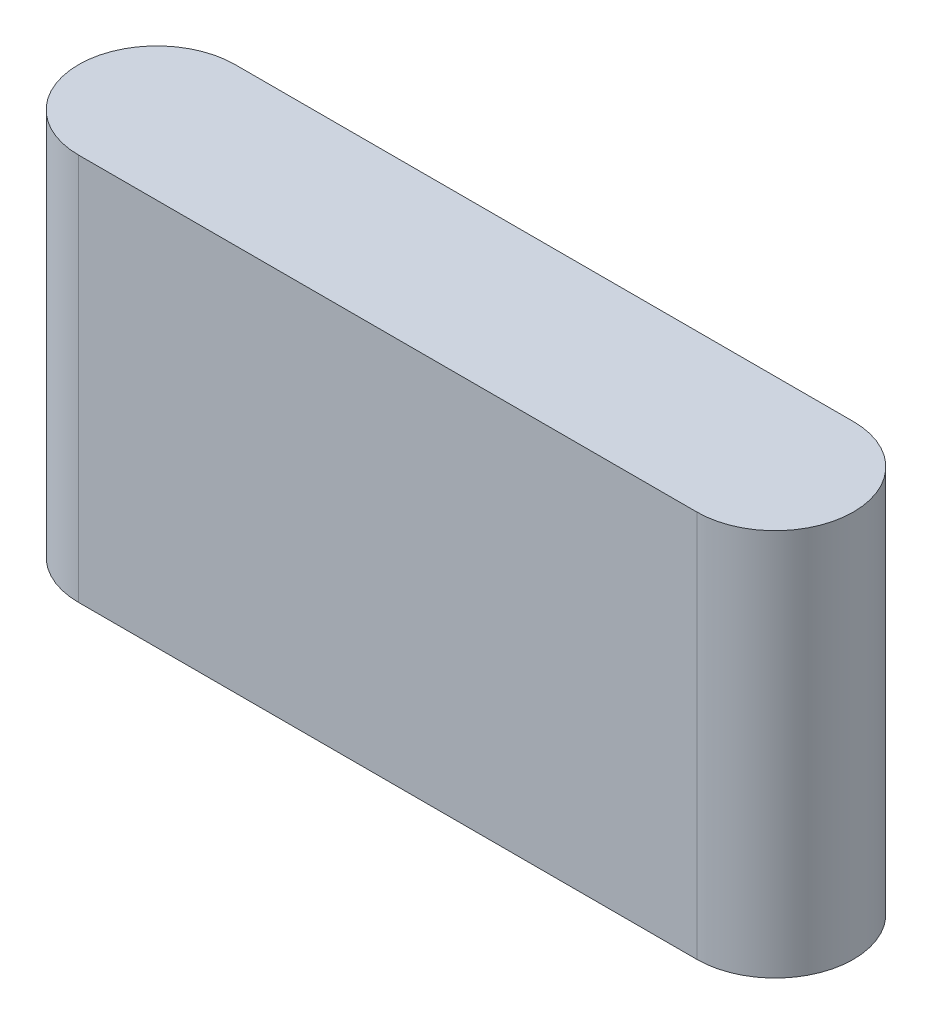
from build123d import *

# Parameters (mm, degrees)
SKICA1_W                 = 94
SKICA1_H                 = 47
P_IDAT_VYSUNUT_M1_DEPTH  = 19
ZAOBLIT4_RADIUS          = 9.5
ZAOBLIT4_LENGTH          = 47
ZAOBLIT5_RADIUS          = 9.5
ZAOBLIT5_LENGTH          = 47
SKICA2_W                 = 2.647435898
SKICA2_H                 = 0.358974359
ODEBRAT_VYSUNUT_M1_DEPTH = 10


with BuildPart() as part:
    # Skica1 → Přidat vysunutím1 (new body)
    with BuildSketch(Plane.XY):
        with Locations((-47, 23.5)):
            Rectangle(SKICA1_W, SKICA1_H)
    extrude(amount=P_IDAT_VYSUNUT_M1_DEPTH)

    # Zaoblit4: full round fillet: the end face becomes a half cylinder, R = half its width
    zaoblit4_face = Plane((0, 23.5, 9.5), x_dir=(0, -1, 0), z_dir=(1, 0, 0))  # on the end face: x along it, z out of the body
    zaoblit4_slab = zaoblit4_face.offset(-ZAOBLIT4_RADIUS / 2) * Box(ZAOBLIT4_LENGTH, 2 * ZAOBLIT4_RADIUS, ZAOBLIT4_RADIUS, mode=Mode.PRIVATE)  # the body's end, R deep
    zaoblit4_round = Plane((-9.5, 23.5, 9.5), x_dir=(1, 0, 0), z_dir=(0, -1, 0)) * Cylinder(ZAOBLIT4_RADIUS, ZAOBLIT4_LENGTH, mode=Mode.PRIVATE)  # its axis R under the face
    add(zaoblit4_slab - zaoblit4_round, mode=Mode.SUBTRACT)

    # Zaoblit5: full round fillet: the end face becomes a half cylinder, R = half its width
    zaoblit5_face = Plane((-94, 23.5, 9.5), x_dir=(0, 1, 0), z_dir=(-1, 0, 0))  # on the end face: x along it, z out of the body
    zaoblit5_slab = zaoblit5_face.offset(-ZAOBLIT5_RADIUS / 2) * Box(ZAOBLIT5_LENGTH, 2 * ZAOBLIT5_RADIUS, ZAOBLIT5_RADIUS, mode=Mode.PRIVATE)  # the body's end, R deep
    zaoblit5_round = Plane((-84.5, 23.5, 9.5), x_dir=(-1, 0, 0), z_dir=(0, 1, 0)) * Cylinder(ZAOBLIT5_RADIUS, ZAOBLIT5_LENGTH, mode=Mode.PRIVATE)  # its axis R under the face
    add(zaoblit5_slab - zaoblit5_round, mode=Mode.SUBTRACT)

    # Skica2 → Odebrat vysunutím1 (cut)
    # profile 1 of 18: a face of its own
    with BuildSketch(Plane(origin=(0, 0, 0), x_dir=(-1, 0, 0), z_dir=(0, 0, -1))):
        Polygon((16.478127812, 39.880074666), (16.478127812, 43.380074666), (16.619754415, 43.380074666), (21.234538069, 40.700387166), (21.234538069, 43.380074666), (21.907614992, 43.380074666), (21.907614992, 39.880074666), (21.75477044, 39.880074666), (17.151204735, 42.552750948), (17.151204735, 39.880074666), align=None)
    # profile 2 of 18: a face of its own
    with BuildSketch(Plane(origin=(0, 0, 0), x_dir=(-1, 0, 0), z_dir=(0, 0, -1))):
        with BuildLine():
            Line((28.593512428, 42.437766974), (28.593512428, 39.880074666))
            Line((28.593512428, 39.880074666), (27.920435505, 39.880074666))
            Line((27.920435505, 39.880074666), (27.920435505, 40.322482519))
            add(Edge.make_bspline(
                [(27.920435505, 40.322482519), (27.885798732, 40.301822648), (27.816231491, 40.260327725), (27.707987038, 40.203753519), (27.59660187, 40.151235101), (27.482213965, 40.102848615), (27.364840901, 40.058529454), (27.244133201, 40.018580888), (27.120137861, 39.982935416), (26.949366626, 39.940537316), (26.72818446, 39.897942374), (26.453078502, 39.861975369), (26.166164781, 39.838648818), (25.970662273, 39.836365957), (25.871056498, 39.835202871)],
                knots=[0, 0, 0, 0, 0.680497769, 1.366765706, 2.060125554, 2.758225309, 3.462182975, 4.176831615, 4.903320908, 5.638917205, 7.145681392, 8.701364552, 10.319391675, 12, 12, 12, 12], degree=3))
            add(Edge.make_bspline(
                [(25.871056498, 39.835202871), (25.782449942, 39.836429913), (25.608084649, 39.83884456), (25.351608198, 39.857410082), (25.104934686, 39.887342529), (24.868134746, 39.929053665), (24.641316137, 39.983883142), (24.42435492, 40.050249193), (24.217219732, 40.129002036), (24.052887837, 40.204818815), (23.928492817, 40.270791853), (23.84147248, 40.320933267), (23.760934304, 40.373222583), (23.685283802, 40.425272868), (23.616952811, 40.480469581), (23.553089559, 40.53542699), (23.496675616, 40.593311489), (23.44499858, 40.651300455), (23.39989567, 40.711047417), (23.361439934, 40.77226938), (23.327916665, 40.834382067), (23.30072388, 40.897965758), (23.279185089, 40.963110509), (23.264964204, 41.029676289), (23.255139762, 41.097397971), (23.254227692, 41.14299338), (23.253768838, 41.165932038)],
                knots=[0, 0, 0, 0, 1.999740434, 3.935209126, 5.800531288, 7.606118056, 9.358876658, 11.064105284, 12.723637649, 14.356813612, 15.144943884, 15.901295183, 16.622642494, 17.311897042, 17.972584089, 18.604270769, 19.212255653, 19.79531406, 20.356561532, 20.899489215, 21.425735452, 21.947974512, 22.458412167, 22.971622335, 23.48263203, 24, 24, 24, 24], degree=3))
            add(Edge.make_bspline(
                [(23.253768838, 41.165932038), (23.254249814, 41.188398654), (23.255205817, 41.233053958), (23.264711001, 41.299508826), (23.280257506, 41.364643916), (23.30118037, 41.428861515), (23.328871229, 41.491308344), (23.3620538, 41.552791594), (23.401343533, 41.613140838), (23.447205544, 41.671888229), (23.498502901, 41.729737863), (23.556500757, 41.785784175), (23.619937115, 41.841073707), (23.69001976, 41.894489809), (23.765795597, 41.946779621), (23.846923904, 41.999081879), (23.935162028, 42.048488843), (24.06059238, 42.114258615), (24.226694877, 42.189578144), (24.435407835, 42.268113887), (24.653826635, 42.334945184), (24.882361739, 42.388331758), (25.120040244, 42.431396463), (25.36771906, 42.461287681), (25.625174723, 42.478788414), (25.800216, 42.481340262), (25.889285665, 42.482638769)],
                knots=[0, 0, 0, 0, 0.506082622, 1.005904642, 1.509266444, 2.013949263, 2.525755442, 3.046588502, 3.58712989, 4.146561918, 4.724819192, 5.328221043, 5.962947707, 6.620326117, 7.312887807, 8.037610356, 8.794794899, 9.59108926, 11.229240974, 12.901111033, 14.613906485, 16.373110066, 18.187341788, 20.055151822, 21.992666017, 24, 24, 24, 24], degree=3))
            add(Edge.make_bspline(
                [(25.889285665, 42.482638769), (25.941172737, 42.482177397), (26.04357453, 42.481266855), (26.195326013, 42.475763488), (26.343056383, 42.465773575), (26.487123017, 42.452693784), (26.627430376, 42.435182875), (26.763941927, 42.413400293), (26.896742957, 42.388121039), (27.025907191, 42.359509941), (27.151425594, 42.326823166), (27.273056272, 42.288827049), (27.390666164, 42.246080055), (27.504375785, 42.199104405), (27.61422352, 42.147864936), (27.720178967, 42.091636342), (27.822567886, 42.030974723), (27.887934242, 41.986582386), (27.920435505, 41.964509762)],
                knots=[0, 0, 0, 0, 1.169714888, 2.308492209, 3.42259105, 4.5072635, 5.569164621, 6.60942422, 7.623074167, 8.616253728, 9.591283059, 10.546104198, 11.487752741, 12.411365387, 13.31878794, 14.219085876, 15.114499253, 16, 16, 16, 16], degree=3))
            Line((27.920435505, 41.964509762), (27.920435505, 42.437766974))
            Line((27.920435505, 42.437766974), (28.593512428, 42.437766974))
        make_face()
        with BuildLine():
            add(Edge.make_bspline(
                [(25.925743998, 42.168536205), (25.83711142, 42.166927626), (25.66323704, 42.163772006), (25.40737981, 42.138715502), (25.16204327, 42.09771818), (24.965416116, 42.049600575), (24.815536592, 42.003617672), (24.709701885, 41.965936135), (24.609768742, 41.924519168), (24.515865356, 41.879494326), (24.427256671, 41.832182386), (24.344912875, 41.780736421), (24.268318061, 41.725979945), (24.1977337, 41.668434096), (24.135153963, 41.608008069), (24.078905891, 41.548106062), (24.032231264, 41.485960983), (23.994625148, 41.422674222), (23.963374839, 41.359328036), (23.942619744, 41.294317154), (23.929262072, 41.228646216), (23.927649677, 41.184458008), (23.926845761, 41.162426429)],
                knots=[0, 0, 0, 0, 2.192333186, 4.300795249, 6.352913075, 8.341320724, 9.303261864, 10.230433036, 11.119469197, 11.978035342, 12.805837773, 13.603156911, 14.378088524, 15.133912734, 15.853626104, 16.528789964, 17.164768491, 17.771591068, 18.348277167, 18.90775189, 19.455421447, 20, 20, 20, 20], degree=3))
            add(Edge.make_bspline(
                [(23.926845761, 41.162426429), (23.927695121, 41.140641738), (23.92940781, 41.096714104), (23.942190983, 41.031234437), (23.964857365, 40.966972412), (23.993848544, 40.902702673), (24.033530496, 40.84015051), (24.080227778, 40.777619548), (24.136578626, 40.716649131), (24.199640753, 40.655707196), (24.271357536, 40.598234767), (24.348376294, 40.542669104), (24.431473692, 40.490599461), (24.520445435, 40.442614627), (24.615159329, 40.397320986), (24.715647616, 40.355709852), (24.822003692, 40.316842553), (24.972455482, 40.270293848), (25.168446087, 40.2207736), (25.412334655, 40.180113769), (25.664120042, 40.153929876), (25.834999533, 40.150860066), (25.921537267, 40.149305435)],
                knots=[0, 0, 0, 0, 0.539522642, 1.087917782, 1.644472343, 2.224701748, 2.830394652, 3.475321794, 4.155654897, 4.884506976, 5.645814172, 6.42985065, 7.236204435, 8.072951087, 8.932654708, 9.835782822, 10.766147765, 11.7366084, 13.736057715, 15.768062985, 17.856839102, 20, 20, 20, 20], degree=3))
            add(Edge.make_bspline(
                [(25.921537267, 40.149305435), (26.009234353, 40.15093806), (26.182404933, 40.154161912), (26.438702889, 40.179318305), (26.687756603, 40.220427853), (26.889404331, 40.268672181), (27.043692984, 40.315714761), (27.152983863, 40.352538883), (27.255158177, 40.393236691), (27.350545862, 40.43644788), (27.438954462, 40.482831446), (27.519975775, 40.532928663), (27.59562056, 40.584112959), (27.662762255, 40.639974431), (27.723373496, 40.697231784), (27.776304105, 40.756799563), (27.820691466, 40.818623679), (27.856705613, 40.88217341), (27.885146763, 40.947198942), (27.905722055, 41.014167584), (27.917836006, 41.083228758), (27.919566935, 41.129895007), (27.920435505, 41.153311846)],
                knots=[0, 0, 0, 0, 2.161041805, 4.2672896, 6.340076238, 8.37831556, 9.371364352, 10.314887074, 11.21974883, 12.08064592, 12.894821863, 13.6781799, 14.427511408, 15.143609076, 15.828035871, 16.480957747, 17.104324631, 17.700153906, 18.277977099, 18.850087985, 19.422981175, 20, 20, 20, 20], degree=3))
            add(Edge.make_bspline(
                [(27.920435505, 41.153311846), (27.918639511, 41.188760663), (27.91506722, 41.259269577), (27.887428445, 41.362820933), (27.840804653, 41.460813073), (27.777381371, 41.555016358), (27.694628469, 41.643156825), (27.595018205, 41.727742733), (27.476692497, 41.806658995), (27.342595806, 41.880574206), (27.195455278, 41.947741639), (27.039000595, 42.007696657), (26.873661853, 42.057223827), (26.700061305, 42.097546726), (26.51831166, 42.130232154), (26.328121983, 42.15172733), (26.12977636, 42.166686035), (25.994717304, 42.167910753), (25.925743998, 42.168536205)],
                knots=[0, 0, 0, 0, 0.697496698, 1.387344891, 2.09353272, 2.826201703, 3.614394564, 4.466490315, 5.39446187, 6.410049077, 7.4788009, 8.577107957, 9.706898259, 10.874550543, 12.085163427, 13.341013386, 14.642082191, 16, 16, 16, 16], degree=3))
        make_face(mode=Mode.SUBTRACT)
    # profile 3 of 18: a face of its own
    with BuildSketch(Plane(origin=(0, 0, 0), x_dir=(-1, 0, 0), z_dir=(0, 0, -1))):
        with BuildLine():
            Line((30.029409864, 42.437766974), (30.702486787, 42.437766974))
            Line((30.702486787, 42.437766974), (30.702486787, 41.976428833))
            add(Edge.make_bspline(
                [(30.702486787, 41.976428833), (30.735224614, 41.99804284), (30.800919822, 42.041415808), (30.903232384, 42.100122338), (31.007223663, 42.156394458), (31.1144029, 42.206427308), (31.22431609, 42.25236185), (31.336789723, 42.293191864), (31.451589675, 42.331042603), (31.609501986, 42.373660977), (31.813922494, 42.417870868), (32.067785838, 42.455425101), (32.332176424, 42.478220748), (32.511802644, 42.481148576), (32.603227973, 42.482638769)],
                knots=[0, 0, 0, 0, 0.707031565, 1.418804793, 2.125622925, 2.838044262, 3.550066833, 4.272496367, 4.994630992, 5.728493742, 7.220098066, 8.762134466, 10.352006062, 12, 12, 12, 12], degree=3))
            add(Edge.make_bspline(
                [(32.603227973, 42.482638769), (32.649979473, 42.482313086), (32.742135028, 42.481671107), (32.878450331, 42.474238605), (33.010580098, 42.463231971), (33.138796092, 42.447918679), (33.263017183, 42.427604742), (33.383234755, 42.402456693), (33.499439782, 42.372802838), (33.61118564, 42.339599937), (33.717079453, 42.301866801), (33.816651716, 42.261184329), (33.908872638, 42.217177171), (33.994274469, 42.170496504), (34.071552034, 42.119381634), (34.142853944, 42.066688741), (34.205948933, 42.009393444), (34.263225145, 41.949484007), (34.31342637, 41.883014376), (34.355922479, 41.808452275), (34.391884431, 41.72540185), (34.420970082, 41.633962611), (34.444183144, 41.534118274), (34.459808408, 41.425515257), (34.469713338, 41.30867738), (34.471036109, 41.227885696), (34.471717556, 41.18626457)],
                knots=[0, 0, 0, 0, 1.296114654, 2.55487341, 3.78394462, 4.971861098, 6.134085804, 7.272769805, 8.376038232, 9.458463207, 10.503708496, 11.491645716, 12.439410175, 13.3356455, 14.18754174, 15.006595089, 15.791191594, 16.547559039, 17.301814033, 18.094291312, 18.921328646, 19.806580685, 20.751238874, 21.760202865, 22.846132754, 24, 24, 24, 24], degree=3))
            Line((34.471717556, 41.18626457), (34.471717556, 39.880074666))
            Line((34.471717556, 39.880074666), (33.798640633, 39.880074666))
            Line((33.798640633, 39.880074666), (33.798640633, 41.083199666))
            add(Edge.make_bspline(
                [(33.798640633, 41.083199666), (33.798592936, 41.118024961), (33.798501687, 41.184650131), (33.795446266, 41.280011445), (33.791559115, 41.366535493), (33.785467815, 41.443962835), (33.777096971, 41.512259354), (33.76717025, 41.571392022), (33.757023521, 41.621902853), (33.746579046, 41.651657703), (33.741849767, 41.665130756)],
                knots=[0, 0, 0, 0, 1.423723719, 2.723762602, 3.9004223, 4.964505373, 5.89840362, 6.712092852, 7.416833175, 8, 8, 8, 8], degree=3))
            add(Edge.make_bspline(
                [(33.741849767, 41.665130756), (33.733713559, 41.685697852), (33.717517968, 41.726637837), (33.684029253, 41.784010523), (33.642530151, 41.837002158), (33.594487754, 41.886850212), (33.538153425, 41.931683622), (33.475557273, 41.973499902), (33.404946559, 42.010177128), (33.3277807, 42.044072883), (33.243598593, 42.072880241), (33.153634326, 42.099124966), (33.057368647, 42.120701203), (32.954803305, 42.137914386), (32.846080405, 42.152072984), (32.730979283, 42.161705192), (32.60982616, 42.167201968), (32.527045065, 42.168084944), (32.484738389, 42.168536205)],
                knots=[0, 0, 0, 0, 0.738707167, 1.470438976, 2.211250668, 2.984838245, 3.77925683, 4.613596044, 5.497916662, 6.435680959, 7.429086455, 8.47017583, 9.567704011, 10.725095665, 11.946246819, 13.232340697, 14.585541016, 16, 16, 16, 16], degree=3))
            add(Edge.make_bspline(
                [(32.484738389, 42.168536205), (32.435880262, 42.168053859), (32.339244878, 42.167099839), (32.196046054, 42.15780198), (32.056684701, 42.142198379), (31.920988725, 42.121850681), (31.789823034, 42.092903606), (31.661655336, 42.060763108), (31.537866917, 42.02033071), (31.418554702, 41.975420871), (31.306905565, 41.925253172), (31.203631007, 41.872655687), (31.110477732, 41.817180125), (31.027836013, 41.757620247), (30.954491667, 41.696383723), (30.891474977, 41.631351924), (30.838278923, 41.563499684), (30.810170354, 41.514965377), (30.796437107, 41.491252551)],
                knots=[0, 0, 0, 0, 1.23837769, 2.449359199, 3.63545086, 4.792545516, 5.925425362, 7.038995472, 8.140603884, 9.224354138, 10.269176385, 11.241552236, 12.161020395, 13.014285585, 13.821365044, 14.579681589, 15.306062766, 16, 16, 16, 16], degree=3))
            add(Edge.make_bspline(
                [(30.796437107, 41.491252551), (30.788881035, 41.474078668), (30.772627792, 41.437137351), (30.753530188, 41.375347355), (30.737359568, 41.30386803), (30.72556152, 41.222677347), (30.714833229, 41.131999742), (30.7072173, 41.031663521), (30.703256367, 40.921507622), (30.702750456, 40.844821377), (30.702486787, 40.804854313)],
                knots=[0, 0, 0, 0, 0.645092169, 1.387604398, 2.220479494, 3.164333066, 4.208538775, 5.361718932, 6.624990091, 8, 8, 8, 8], degree=3))
            Line((30.702486787, 40.804854313), (30.702486787, 39.880074666))
            Line((30.702486787, 39.880074666), (30.029409864, 39.880074666))
            Line((30.029409864, 39.880074666), (30.029409864, 42.437766974))
        make_face()
    # profile 4 of 18: a face of its own
    with BuildSketch(Plane(origin=(0, 0, 0), x_dir=(-1, 0, 0), z_dir=(0, 0, -1))):
        with BuildLine():
            add(Edge.make_bspline(
                [(38.33279528, 42.482638769), (38.428420643, 42.48160087), (38.615924938, 42.479565735), (38.890643789, 42.458527511), (39.152988281, 42.425804659), (39.402855499, 42.381059121), (39.639922456, 42.320973186), (39.864706388, 42.249003404), (40.077621842, 42.164309127), (40.211142575, 42.095303727), (40.277006017, 42.06126457)],
                knots=[0, 0, 0, 0, 1.141732177, 2.238733323, 3.287950236, 4.297916352, 5.267886779, 6.206080081, 7.115090672, 8, 8, 8, 8], degree=3))
            add(Edge.make_bspline(
                [(40.277006017, 42.06126457), (40.305436173, 42.045397291), (40.361105127, 42.014327648), (40.440477344, 41.964219766), (40.514618514, 41.91322648), (40.583415778, 41.861596472), (40.646292009, 41.808595781), (40.703878098, 41.754550378), (40.756487943, 41.699633637), (40.802974594, 41.642896248), (40.844775772, 41.5857872), (40.87960466, 41.526442564), (40.909863776, 41.466756131), (40.935672805, 41.406386683), (40.954541816, 41.344259353), (40.967575215, 41.281090871), (40.976600998, 41.21690318), (40.977616497, 41.17367531), (40.978127812, 41.151909602)],
                knots=[0, 0, 0, 0, 1.294274395, 2.53431261, 3.730223525, 4.871271173, 5.952726652, 6.997927765, 8.010102008, 8.973772379, 9.912435195, 10.820760012, 11.70588071, 12.572170046, 13.427476429, 14.282176927, 15.13505719, 16, 16, 16, 16], degree=3))
            add(Edge.make_bspline(
                [(40.978127812, 41.151909602), (40.977670335, 41.130136269), (40.976756227, 41.086629846), (40.966837285, 41.022249136), (40.953296598, 40.958460609), (40.932384731, 40.896042607), (40.907017304, 40.834157087), (40.87360906, 40.774475232), (40.837049728, 40.714479891), (40.793126449, 40.656489542), (40.7437725, 40.599283371), (40.688158377, 40.543437858), (40.627257644, 40.488001984), (40.560479377, 40.434013333), (40.487925091, 40.38150208), (40.409896838, 40.329436513), (40.325929359, 40.278429717), (40.205238557, 40.211670956), (40.044466018, 40.133511174), (39.838474094, 40.054320262), (39.619834069, 39.985948484), (39.387777402, 39.931107877), (39.142722176, 39.887572736), (38.88450371, 39.857223664), (38.613047371, 39.838779337), (38.42771043, 39.83641414), (38.33279528, 39.835202871)],
                knots=[0, 0, 0, 0, 0.488275347, 0.975648255, 1.459252358, 1.950253089, 2.450991837, 2.957955929, 3.483389192, 4.026816024, 4.588370341, 5.178124795, 5.794545692, 6.435990364, 7.104323948, 7.804091683, 8.540863577, 9.308650886, 10.899259995, 12.548401291, 14.257234187, 16.037133816, 17.896449442, 19.840513876, 21.869835087, 24, 24, 24, 24], degree=3))
            add(Edge.make_bspline(
                [(38.33279528, 39.835202871), (38.237646912, 39.836421184), (38.051610784, 39.838803254), (37.779216516, 39.857186728), (37.520066096, 39.887573199), (37.274316418, 39.931124853), (37.041759285, 39.985845211), (36.822902272, 40.054307082), (36.616756317, 40.133668581), (36.45566715, 40.211621396), (36.33483409, 40.278184616), (36.251304986, 40.329881778), (36.172816542, 40.381241105), (36.10026117, 40.434086342), (36.033428935, 40.487748134), (35.973214309, 40.543682072), (35.91758366, 40.599252916), (35.868264388, 40.656497255), (35.824332316, 40.714477926), (35.787775223, 40.774475731), (35.754366408, 40.834156957), (35.72899913, 40.896042641), (35.708087224, 40.9584606), (35.694546546, 41.022249138), (35.684627602, 41.086629846), (35.683713494, 41.130136269), (35.683256017, 41.151909602)],
                knots=[0, 0, 0, 0, 2.132571724, 4.16964991, 6.116332762, 7.978335832, 9.760965423, 11.467527786, 13.11447786, 14.70769125, 15.474458397, 16.205781008, 16.908983619, 17.576429184, 18.217021566, 18.828755401, 19.417726245, 19.978534423, 20.521239202, 21.045974319, 21.552264806, 22.05233822, 22.542686556, 23.025648092, 23.512373426, 24, 24, 24, 24], degree=3))
            add(Edge.make_bspline(
                [(35.683256017, 41.151909602), (35.683770303, 41.173443103), (35.684797205, 41.216440161), (35.693884292, 41.280364587), (35.706570354, 41.343721126), (35.726802911, 41.40537757), (35.751296767, 41.466231753), (35.781657362, 41.525597085), (35.816808661, 41.584496172), (35.858415884, 41.641479845), (35.90467119, 41.698215368), (35.957760136, 41.75243517), (36.015288262, 41.806766455), (36.078373105, 41.859728817), (36.146601061, 41.912146028), (36.221169901, 41.961969075), (36.30023814, 42.012282478), (36.355933944, 42.043313599), (36.384377812, 42.059161205)],
                knots=[0, 0, 0, 0, 0.85696117, 1.711138758, 2.56713935, 3.42652246, 4.290578758, 5.177045823, 6.078768283, 7.018858909, 7.98399513, 8.990980406, 10.037771386, 11.133985434, 12.269356016, 13.461832419, 14.70375687, 16, 16, 16, 16], degree=3))
            add(Edge.make_bspline(
                [(36.384377812, 42.059161205), (36.450209019, 42.093506999), (36.583569425, 42.163084472), (36.796847748, 42.247317995), (37.021701019, 42.320817487), (37.259628635, 42.379827875), (37.510141697, 42.426253702), (37.773109194, 42.458327979), (38.048722414, 42.479645237), (38.236699679, 42.481626123), (38.33279528, 42.482638769)],
                knots=[0, 0, 0, 0, 0.88403884, 1.790879806, 2.727690637, 3.700746165, 4.708805497, 5.761043055, 6.85542588, 8, 8, 8, 8], degree=3))
        make_face()
        with BuildLine():
            add(Edge.make_bspline(
                [(38.330691915, 42.168536205), (38.26429406, 42.167572186), (38.133685377, 42.165675902), (37.941552921, 42.151380702), (37.756656507, 42.128393375), (37.578643935, 42.096331224), (37.407732691, 42.054313245), (37.243992055, 42.003190392), (37.087412977, 41.94274598), (36.939988982, 41.873337424), (36.804222741, 41.798631275), (36.68568458, 41.717544417), (36.58442791, 41.633929555), (36.501507567, 41.545367771), (36.436791898, 41.452436133), (36.390456742, 41.355197188), (36.361457097, 41.253826974), (36.358046034, 41.18458215), (36.35633294, 41.149806237)],
                knots=[0, 0, 0, 0, 1.320627085, 2.597755057, 3.829945598, 5.025344416, 6.19341345, 7.328473088, 8.435211287, 9.529075261, 10.567574925, 11.514001677, 12.381812654, 13.174559728, 13.919872877, 14.624788673, 15.309345794, 16, 16, 16, 16], degree=3))
            add(Edge.make_bspline(
                [(36.35633294, 41.149806237), (36.357128882, 41.127306695), (36.358724925, 41.082189976), (36.372134741, 41.015441637), (36.392262605, 40.949292656), (36.422321624, 40.884969935), (36.459562191, 40.821339615), (36.505647997, 40.759738064), (36.559395416, 40.698812607), (36.621705858, 40.639948891), (36.690527357, 40.582658821), (36.766285599, 40.529204994), (36.84759054, 40.479198408), (36.93385989, 40.43082806), (37.027040874, 40.38779617), (37.125487982, 40.347238993), (37.229786042, 40.30986502), (37.377643419, 40.265038009), (37.571914753, 40.217908119), (37.815242682, 40.178701601), (38.069327677, 40.153130284), (38.24252066, 40.150595748), (38.330691915, 40.149305435)],
                knots=[0, 0, 0, 0, 0.560739757, 1.124411309, 1.692317552, 2.281892331, 2.890778358, 3.528560669, 4.197627343, 4.915078785, 5.66447979, 6.429588511, 7.225503147, 8.044835433, 8.895007561, 9.783816292, 10.700261008, 11.657338477, 13.636850713, 15.681102066, 17.801281278, 20, 20, 20, 20], degree=3))
            add(Edge.make_bspline(
                [(38.330691915, 40.149305435), (38.418862254, 40.150600615), (38.592053436, 40.153144709), (38.845921715, 40.178624066), (39.088977996, 40.218021434), (39.283064316, 40.264966867), (39.431067146, 40.310039899), (39.535548588, 40.346922589), (39.633821205, 40.387946179), (39.72693367, 40.43103933), (39.813574296, 40.478777562), (39.894482651, 40.529447476), (39.970163366, 40.582636236), (40.039017241, 40.639916838), (40.101243419, 40.699058155), (40.155773925, 40.759496816), (40.201788952, 40.821368657), (40.239070499, 40.884962567), (40.269119122, 40.949294524), (40.289249636, 41.015441151), (40.302658769, 41.082190096), (40.304254903, 41.127306736), (40.305050889, 41.149806237)],
                knots=[0, 0, 0, 0, 2.198896379, 4.319246902, 6.357911055, 8.337583235, 9.294738037, 10.2167477, 11.100239241, 11.950480062, 12.77498569, 13.566017094, 14.331187636, 15.080649193, 15.798158606, 16.471154222, 17.108988067, 17.717923292, 18.307545708, 18.875497839, 19.439214935, 20, 20, 20, 20], degree=3))
            add(Edge.make_bspline(
                [(40.305050889, 41.149806237), (40.303336513, 41.184580924), (40.299922896, 41.253823307), (40.270942468, 41.355211885), (40.224530875, 41.452377786), (40.159942682, 41.545869652), (40.075455719, 41.633384879), (39.974233653, 41.718085658), (39.854480693, 41.798145869), (39.718646434, 41.873407252), (39.570981373, 41.942890812), (39.414066857, 42.003053457), (39.250357559, 42.054214429), (39.079726476, 42.096436683), (38.902144284, 42.128312358), (38.71773222, 42.151397082), (38.52652946, 42.165654139), (38.396622033, 42.167565936), (38.330691915, 42.168536205)],
                knots=[0, 0, 0, 0, 0.690856322, 1.375613774, 2.08073586, 2.82626712, 3.625601418, 4.493666355, 5.448058841, 6.486862415, 7.581046502, 8.692445909, 9.827837715, 10.991733581, 12.187482225, 13.41541963, 14.688283685, 16, 16, 16, 16], degree=3))
        make_face(mode=Mode.SUBTRACT)
    # profile 5 of 18: a face of its own
    with BuildSketch(Plane(origin=(0, 0, 0), x_dir=(-1, 0, 0), z_dir=(0, 0, -1))):
        with Locations((43.064666274, 41.226228513)):
            Rectangle(SKICA2_W, SKICA2_H)
    # profile 6 of 18: a face of its own
    with BuildSketch(Plane(origin=(0, 0, 0), x_dir=(-1, 0, 0), z_dir=(0, 0, -1))):
        Polygon((45.958897043, 43.469818256), (46.631973966, 43.469818256), (46.631973966, 42.437766974), (47.664025248, 42.437766974), (47.664025248, 42.12366441), (46.631973966, 42.12366441), (46.631973966, 39.880074666), (45.958897043, 39.880074666), (45.958897043, 42.12366441), (45.061461146, 42.12366441), (45.061461146, 42.437766974), (45.958897043, 42.437766974), align=None)
    # profile 7 of 18: a face of its own
    with BuildSketch(Plane(origin=(0, 0, 0), x_dir=(-1, 0, 0), z_dir=(0, 0, -1))):
        with BuildLine():
            Line((52.944173485, 40.687766974), (53.497358581, 40.541232519))
            add(Edge.make_bspline(
                [(53.497358581, 40.541232519), (53.451345094, 40.501275452), (53.358890732, 40.420990185), (53.206128309, 40.316837671), (53.044671591, 40.221695123), (52.871085165, 40.140973727), (52.687281758, 40.07006276), (52.492738297, 40.008801209), (52.28737182, 39.955260649), (52.070202149, 39.911146117), (51.840145624, 39.876929228), (51.596108281, 39.852720109), (51.337622391, 39.837845291), (51.16030654, 39.836098617), (51.069373806, 39.835202871)],
                knots=[0, 0, 0, 0, 0.847941424, 1.703758758, 2.570031127, 3.455146383, 4.365914944, 5.311771122, 6.29370506, 7.31999138, 8.396049726, 9.531043921, 10.733847399, 12, 12, 12, 12], degree=3))
            add(Edge.make_bspline(
                [(51.069373806, 39.835202871), (51.01842065, 39.835397905), (50.917658209, 39.835783595), (50.768767045, 39.841078535), (50.624028744, 39.848392191), (50.483802646, 39.859904004), (50.34744769, 39.87360581), (50.215405696, 39.891303416), (50.087422007, 39.911330553), (49.96406287, 39.935445653), (49.844670242, 39.961729017), (49.729746423, 39.992151994), (49.618717741, 40.024770993), (49.512227917, 40.061489848), (49.409564391, 40.100461045), (49.311503708, 40.143465415), (49.217225462, 40.188827601), (49.127814718, 40.237872272), (49.043574276, 40.289066077), (48.963725867, 40.340223887), (48.889696508, 40.392492014), (48.821147072, 40.446097296), (48.758449095, 40.500647158), (48.700337486, 40.555320975), (48.648454552, 40.611415714), (48.602347796, 40.6684398), (48.560125457, 40.725340247), (48.524605698, 40.783862477), (48.495289462, 40.843570584), (48.469240387, 40.902999612), (48.450554757, 40.96425756), (48.437380672, 41.026218825), (48.428410926, 41.088783463), (48.42736803, 41.13084546), (48.426845761, 41.151909602)],
                knots=[0, 0, 0, 0, 1.522945897, 3.011702527, 4.452806143, 5.854409133, 7.216816944, 8.548613896, 9.836049499, 11.088263584, 12.305139009, 13.489518455, 14.641057054, 15.76329999, 16.855662783, 17.922463478, 18.962863293, 19.98200912, 20.969194552, 21.908971954, 22.816064023, 23.676893447, 24.50886613, 25.299454398, 26.060735063, 26.790631697, 27.490666793, 28.177151428, 28.83321209, 29.478056573, 30.114407118, 30.743313809, 31.370666682, 32, 32, 32, 32], degree=3))
            add(Edge.make_bspline(
                [(48.426845761, 41.151909602), (48.428530225, 41.191344578), (48.431902206, 41.270285995), (48.4615753, 41.386391126), (48.50834782, 41.499381415), (48.574673662, 41.608481265), (48.659021234, 41.714438429), (48.762756989, 41.815846189), (48.883650335, 41.915497447), (48.974267491, 41.974953261), (49.021397043, 42.005875948)],
                knots=[0, 0, 0, 0, 0.869182141, 1.7399394, 2.627958431, 3.560367105, 4.548026744, 5.609442935, 6.756682615, 8, 8, 8, 8], degree=3))
            add(Edge.make_bspline(
                [(49.021397043, 42.005875948), (49.053231302, 42.025357784), (49.117447676, 42.064656729), (49.217866331, 42.118175013), (49.321982484, 42.169127474), (49.430189386, 42.215601251), (49.542261939, 42.258999573), (49.658697312, 42.296758768), (49.778567944, 42.333171678), (49.902939258, 42.364276383), (50.030980821, 42.392597148), (50.163269012, 42.415932249), (50.299200766, 42.437417644), (50.439302507, 42.454047926), (50.583357553, 42.466522763), (50.731342001, 42.475579052), (50.883298079, 42.481307568), (50.985935301, 42.482191765), (51.037823325, 42.482638769)],
                knots=[0, 0, 0, 0, 0.853186502, 1.721056019, 2.60052793, 3.502852068, 4.412864818, 5.347321866, 6.300850352, 7.276755177, 8.277720422, 9.298612738, 10.3475918, 11.423977994, 12.523629523, 13.653265929, 14.813613686, 16, 16, 16, 16], degree=3))
            add(Edge.make_bspline(
                [(51.037823325, 42.482638769), (51.091346665, 42.482181426), (51.197020039, 42.481278474), (51.35343734, 42.475719541), (51.505886924, 42.465980924), (51.654080954, 42.451834881), (51.798403775, 42.434549203), (51.938396999, 42.412617351), (52.074586791, 42.387672201), (52.206705675, 42.35811949), (52.334597824, 42.324566208), (52.458592443, 42.287306876), (52.578279291, 42.246315215), (52.693525248, 42.200188372), (52.805212105, 42.151596296), (52.912433905, 42.097747014), (53.016482681, 42.041786548), (53.08252552, 41.999957836), (53.115247203, 41.97923332)],
                knots=[0, 0, 0, 0, 1.185605568, 2.340790806, 3.466507693, 4.568877724, 5.637999073, 6.685737227, 7.707195997, 8.704439597, 9.683854108, 10.635399358, 11.571855418, 12.485115038, 13.384476547, 14.268873694, 15.142293585, 16, 16, 16, 16], degree=3))
            add(Edge.make_bspline(
                [(53.115247203, 41.97923332), (53.159068337, 41.949415842), (53.243881413, 41.891705971), (53.357828213, 41.794590215), (53.453730851, 41.691008103), (53.533413936, 41.582381158), (53.59590724, 41.467826608), (53.640970897, 41.347494613), (53.670287511, 41.221524949), (53.674643292, 41.135241651), (53.676845761, 41.091613128)],
                knots=[0, 0, 0, 0, 1.15916732, 2.24349619, 3.267550483, 4.241278402, 5.184006664, 6.112875451, 7.045789169, 8, 8, 8, 8], degree=3))
            Line((53.676845761, 41.091613128), (49.099922684, 41.091613128))
            add(Edge.make_bspline(
                [(49.099922684, 41.091613128), (49.102921682, 41.057749437), (49.10890168, 40.99022527), (49.139621621, 40.892243839), (49.186624189, 40.799429694), (49.25007034, 40.711736915), (49.329910642, 40.62914546), (49.425956858, 40.551426501), (49.538571028, 40.478545022), (49.665779918, 40.410757054), (49.805483132, 40.34981858), (49.954324293, 40.295628593), (50.111361168, 40.250433005), (50.276150507, 40.213152366), (50.448931177, 40.184506137), (50.629875871, 40.164712752), (50.818645526, 40.151548451), (50.947121966, 40.150062535), (51.01258294, 40.149305435)],
                knots=[0, 0, 0, 0, 0.703681181, 1.403139633, 2.114414746, 2.854525565, 3.6398891, 4.491109322, 5.412369519, 6.418953739, 7.478466407, 8.572146803, 9.703114485, 10.866506309, 12.075799122, 13.334703691, 14.641985297, 16, 16, 16, 16], degree=3))
            add(Edge.make_bspline(
                [(51.01258294, 40.149305435), (51.076634431, 40.149930117), (51.204135872, 40.151173613), (51.393849684, 40.162660329), (51.580922901, 40.181736324), (51.763592504, 40.207396425), (51.938461261, 40.238841575), (52.101170096, 40.27685418), (52.250417241, 40.318579276), (52.389399564, 40.366339572), (52.524482898, 40.424385241), (52.660012799, 40.498743775), (52.802560964, 40.585115685), (52.895802185, 40.652703857), (52.944173485, 40.687766974)],
                knots=[0, 0, 0, 0, 1.128566608, 2.246534268, 3.347596325, 4.441340887, 5.496267988, 6.4772228, 7.3845671, 8.22590442, 9.065142732, 9.971626831, 10.947728833, 12, 12, 12, 12], degree=3))
        make_face()
        with BuildLine():
            add(Edge.make_bspline(
                [(52.958897043, 41.405715692), (52.935814155, 41.447869806), (52.890008564, 41.531520263), (52.799838205, 41.642781996), (52.695994454, 41.741251883), (52.597267283, 41.811401883), (52.510746413, 41.86101886), (52.440935266, 41.897855731), (52.365045528, 41.931018962), (52.285222484, 41.964271805), (52.199564174, 41.994141879), (52.109211236, 42.02311087), (52.013461944, 42.049414415), (51.878732778, 42.082274333), (51.704792677, 42.117837275), (51.490198537, 42.146480016), (51.270717126, 42.165792113), (51.12246764, 42.167615735), (51.04763903, 42.168536205)],
                knots=[0, 0, 0, 0, 1.067455819, 2.118255051, 3.17021148, 4.243716257, 4.80289377, 5.388960574, 5.998743979, 6.6447196, 7.312428565, 8.016251346, 8.755502937, 9.521005086, 11.101606134, 12.70247534, 14.335581506, 16, 16, 16, 16], degree=3))
            add(Edge.make_bspline(
                [(51.04763903, 42.168536205), (50.986391206, 42.16793054), (50.865892127, 42.166738954), (50.688298562, 42.155331645), (50.517333653, 42.136308153), (50.35260875, 42.111017174), (50.194941551, 42.075915068), (50.043082023, 42.036089283), (49.898236534, 41.986884561), (49.805509128, 41.947980844), (49.759678293, 41.928752551)],
                knots=[0, 0, 0, 0, 1.113871765, 2.191433323, 3.234921215, 4.241929424, 5.220741384, 6.171404573, 7.096210515, 8, 8, 8, 8], degree=3))
            add(Edge.make_bspline(
                [(49.759678293, 41.928752551), (49.727622852, 41.913852361), (49.664398846, 41.884464225), (49.575343838, 41.831811107), (49.491444636, 41.775336104), (49.41380391, 41.712464356), (49.342400995, 41.64383893), (49.27716034, 41.569698613), (49.216507013, 41.491186509), (49.182345493, 41.434358699), (49.165127011, 41.405715692)],
                knots=[0, 0, 0, 0, 1.05270174, 2.076278385, 3.078719954, 4.06405996, 5.049080013, 6.025843837, 7.004963075, 8, 8, 8, 8], degree=3))
            Line((49.165127011, 41.405715692), (52.958897043, 41.405715692))
        make_face(mode=Mode.SUBTRACT)
    # profile 8 of 18: a face of its own
    with BuildSketch(Plane(origin=(0, 0, 0), x_dir=(-1, 0, 0), z_dir=(0, 0, -1))):
        Polygon((54.394794479, 42.437766974), (55.226324928, 42.437766974), (56.503768838, 41.532618737), (57.78191387, 42.437766974), (58.612743197, 42.437766974), (56.919534062, 41.238147583), (58.837102171, 39.880074666), (58.006272844, 39.880074666), (56.503768838, 40.944377551), (55.001965953, 39.880074666), (54.170435505, 39.880074666), (56.088003614, 41.238147583), align=None)
    # profile 9 of 18: a face of its own
    with BuildSketch(Plane(origin=(0, 0, 0), x_dir=(-1, 0, 0), z_dir=(0, 0, -1))):
        with BuildLine():
            Line((68.798640633, 43.380074666), (68.798640633, 43.021100307))
            Line((68.798640633, 43.021100307), (66.392390633, 43.021100307))
            Line((66.392390633, 43.021100307), (66.057254415, 42.087907198))
            add(Edge.make_bspline(
                [(66.057254415, 42.087907198), (66.130083326, 42.100193565), (66.271638546, 42.124074184), (66.479377902, 42.148949192), (66.675836642, 42.165645572), (66.80321667, 42.167592633), (66.864946723, 42.168536205)],
                knots=[0, 0, 0, 0, 1.090418878, 2.119412222, 3.088642199, 4, 4, 4, 4], degree=3))
            add(Edge.make_bspline(
                [(66.864946723, 42.168536205), (66.941397148, 42.167697881), (67.091188627, 42.16605533), (67.310664945, 42.150154504), (67.520136902, 42.125224653), (67.719168539, 42.090427745), (67.90804162, 42.045729712), (68.086275685, 41.990336965), (68.2546958, 41.925187584), (68.411324962, 41.850194255), (68.553486473, 41.767546956), (68.679150387, 41.679766259), (68.784200615, 41.584247728), (68.872311031, 41.484630227), (68.939685249, 41.377460861), (68.988264952, 41.264793817), (69.017167548, 41.145868453), (69.021041326, 41.064657997), (69.022999607, 41.023604313)],
                knots=[0, 0, 0, 0, 1.370689869, 2.685631402, 3.943555281, 5.152033316, 6.306735708, 7.42148363, 8.496229752, 9.542147771, 10.531884169, 11.442396783, 12.284998523, 13.072291276, 13.819914864, 14.544624222, 15.264275314, 16, 16, 16, 16], degree=3))
            add(Edge.make_bspline(
                [(69.022999607, 41.023604313), (69.022056229, 40.995030465), (69.020172383, 40.937970924), (69.004914122, 40.853460755), (68.980088048, 40.770747663), (68.945723793, 40.689592828), (68.900155648, 40.61114734), (68.845832725, 40.53387688), (68.780746271, 40.459273289), (68.707552606, 40.385771506), (68.625415535, 40.315770958), (68.5355534, 40.250253149), (68.43909018, 40.188026562), (68.335271117, 40.131027076), (68.224727768, 40.077313866), (68.107019144, 40.028711405), (67.982417182, 39.983495419), (67.850985099, 39.943439361), (67.713883151, 39.90661135), (67.570983149, 39.876254807), (67.42304224, 39.849352095), (67.269588937, 39.827859767), (67.111047186, 39.810968713), (66.947338775, 39.799469482), (66.778561647, 39.791104345), (66.66420298, 39.790591198), (66.60623278, 39.790331076)],
                knots=[0, 0, 0, 0, 0.69406367, 1.385986025, 2.079608009, 2.789593853, 3.522253784, 4.280233772, 5.081716424, 5.925109588, 6.799286121, 7.701269056, 8.626084803, 9.587080148, 10.577777662, 11.611483973, 12.680491367, 13.79793634, 14.949670725, 16.129423524, 17.347121017, 18.603376243, 19.894207137, 21.22109612, 22.591330103, 24, 24, 24, 24], degree=3))
            add(Edge.make_bspline(
                [(66.60623278, 39.790331076), (66.537262829, 39.791016657), (66.401993246, 39.792361275), (66.203437597, 39.806506161), (66.01284732, 39.826762666), (65.830589272, 39.857143117), (65.656231728, 39.895198808), (65.490689944, 39.943280175), (65.332782437, 39.998356833), (65.184496502, 40.062379062), (65.04757865, 40.133287008), (64.924222324, 40.20988043), (64.814600494, 40.290917404), (64.720397868, 40.378161546), (64.639776906, 40.469709739), (64.574957012, 40.56715967), (64.523867192, 40.669585199), (64.501895746, 40.741619159), (64.490948325, 40.777510563)],
                knots=[0, 0, 0, 0, 1.330892051, 2.610255768, 3.840086114, 5.02876351, 6.1745626, 7.282363394, 8.353724806, 9.400263517, 10.396884193, 11.326826754, 12.200072725, 13.023569101, 13.800500118, 14.548601597, 15.276830985, 16, 16, 16, 16], degree=3))
            Line((64.490948325, 40.777510563), (65.164025248, 40.777510563))
            add(Edge.make_bspline(
                [(65.164025248, 40.777510563), (65.179040099, 40.743716015), (65.208803896, 40.676725402), (65.273264749, 40.586754444), (65.350220047, 40.505971506), (65.442466674, 40.435128146), (65.549999744, 40.373544174), (65.673022907, 40.318386947), (65.811775622, 40.268847841), (65.964973669, 40.227162077), (66.127760274, 40.191996951), (66.297212553, 40.168241727), (66.470359652, 40.15181668), (66.587263366, 40.150147101), (66.646196723, 40.149305435)],
                knots=[0, 0, 0, 0, 0.78212309, 1.550395193, 2.331764822, 3.14036305, 4.006183, 4.95286707, 5.994919627, 7.125922982, 8.316176557, 9.522619647, 10.751106079, 12, 12, 12, 12], degree=3))
            add(Edge.make_bspline(
                [(66.646196723, 40.149305435), (66.703477925, 40.150125798), (66.816062509, 40.151738198), (66.98194571, 40.164079062), (67.141916657, 40.183103249), (67.295296732, 40.211615118), (67.442949099, 40.245962568), (67.583711915, 40.290949951), (67.719391176, 40.341274015), (67.846509679, 40.400845142), (67.963496913, 40.464511454), (68.066085896, 40.53406792), (68.152947476, 40.607805916), (68.225110582, 40.685031868), (68.280585743, 40.767255345), (68.320572715, 40.853277265), (68.34579033, 40.943657928), (68.348538381, 41.005681746), (68.349922684, 41.036925628)],
                knots=[0, 0, 0, 0, 1.313900234, 2.582433766, 3.813982005, 5.007519703, 6.159639866, 7.288943758, 8.395207655, 9.476985286, 10.506471054, 11.447763769, 12.314795856, 13.115419257, 13.864844625, 14.579662406, 15.284519058, 16, 16, 16, 16], degree=3))
            add(Edge.make_bspline(
                [(68.349922684, 41.036925628), (68.34861576, 41.065105835), (68.346029422, 41.120873081), (68.324003875, 41.202107994), (68.288332575, 41.278668772), (68.238935416, 41.351382465), (68.174991602, 41.419468863), (68.097075366, 41.483118692), (68.005724864, 41.543112563), (67.90077304, 41.59739521), (67.784815719, 41.647951415), (67.658346792, 41.691173842), (67.522504589, 41.727030408), (67.377877205, 41.758551687), (67.22341206, 41.780796293), (67.059943111, 41.797807271), (66.88703143, 41.807471595), (66.768670811, 41.808852687), (66.70789544, 41.809561846)],
                knots=[0, 0, 0, 0, 0.682111085, 1.349864334, 2.024026017, 2.721603276, 3.471155294, 4.279848605, 5.154955135, 6.115288558, 7.140256882, 8.218679946, 9.350939005, 10.544172975, 11.804332266, 13.131173007, 14.526925385, 16, 16, 16, 16], degree=3))
            add(Edge.make_bspline(
                [(66.70789544, 41.809561846), (66.655067315, 41.808992124), (66.546544083, 41.807821764), (66.37960565, 41.798900371), (66.204493357, 41.784912713), (66.021001463, 41.765003876), (65.829525517, 41.739887368), (65.629721486, 41.708646936), (65.42186183, 41.672471191), (65.280822949, 41.644393505), (65.208897043, 41.630074666)],
                knots=[0, 0, 0, 0, 0.838455037, 1.722413001, 2.652725057, 3.62643296, 4.651542814, 5.71757991, 6.836029259, 8, 8, 8, 8], degree=3))
            Line((65.208897043, 41.630074666), (65.837102171, 43.380074666))
            Line((65.837102171, 43.380074666), (68.798640633, 43.380074666))
        make_face()
    # profile 10 of 18: a face of its own
    with BuildSketch(Plane(origin=(0, 0, 0), x_dir=(-1, 0, 0), z_dir=(0, 0, -1))):
        with BuildLine():
            add(Edge.make_bspline(
                [(70.862743197, 40.418536205), (70.901583619, 40.417387149), (70.976780351, 40.415162527), (71.085145514, 40.400178611), (71.184471025, 40.373321032), (71.260057034, 40.342324982), (71.314299169, 40.313116314), (71.349240516, 40.290107151), (71.379285913, 40.266360667), (71.403444282, 40.240744866), (71.422589845, 40.214213515), (71.436403593, 40.186332291), (71.444322121, 40.156982318), (71.445488387, 40.136964454), (71.44607653, 40.126869538)],
                knots=[0, 0, 0, 0, 1.975855408, 3.825341228, 5.550017028, 7.197097259, 7.968505672, 8.680751726, 9.323194944, 9.911907849, 10.466116354, 10.981882856, 11.486568227, 12, 12, 12, 12], degree=3))
            add(Edge.make_bspline(
                [(71.44607653, 40.126869538), (71.445495617, 40.117004105), (71.444343498, 40.097438119), (71.436252509, 40.068619001), (71.422604461, 40.040924411), (71.403441082, 40.014395469), (71.37928233, 39.988789134), (71.34926117, 39.964996367), (71.314113473, 39.942127071), (71.260404709, 39.911723945), (71.184391356, 39.881220787), (71.085105269, 39.854434399), (70.976843912, 39.838337989), (70.901593757, 39.836270359), (70.862743197, 39.835202871)],
                knots=[0, 0, 0, 0, 0.502258155, 0.996122225, 1.51257047, 2.067511529, 2.657002597, 3.300294999, 4.013482503, 4.791668555, 6.440925902, 8.167881385, 10.021532899, 12, 12, 12, 12], degree=3))
            add(Edge.make_bspline(
                [(70.862743197, 39.835202871), (70.823890095, 39.836262119), (70.748635017, 39.838313789), (70.640184289, 39.854555085), (70.540569035, 39.881051185), (70.464438909, 39.911815275), (70.410752164, 39.941896882), (70.376139646, 39.965218511), (70.346188306, 39.988765455), (70.322049121, 40.014401195), (70.302881013, 40.04092303), (70.28923411, 40.06861934), (70.281142839, 40.097438034), (70.279990758, 40.117004077), (70.279409864, 40.126869538)],
                knots=[0, 0, 0, 0, 1.978205551, 3.831612014, 5.569829438, 7.218868756, 7.996951933, 8.700141296, 9.343348655, 9.932761793, 10.48762949, 11.004009461, 11.497808243, 12, 12, 12, 12], degree=3))
            add(Edge.make_bspline(
                [(70.279409864, 40.126869538), (70.279997987, 40.136964484), (70.281164214, 40.156982406), (70.289083032, 40.186331943), (70.30289563, 40.214214896), (70.322045925, 40.240739135), (70.346184709, 40.266384368), (70.37616024, 40.289885147), (70.410568607, 40.313342865), (70.464786757, 40.342233316), (70.540488621, 40.373491868), (70.640143873, 40.40005951), (70.748698542, 40.41518694), (70.82390022, 40.417395464), (70.862743197, 40.418536205)],
                knots=[0, 0, 0, 0, 0.513363988, 1.017982728, 1.533681137, 2.087816473, 2.676451653, 3.318810053, 4.021071287, 4.792377855, 6.439240632, 8.175163809, 10.024405452, 12, 12, 12, 12], degree=3))
        make_face()
    # profile 11 of 18: a face of its own
    with BuildSketch(Plane(origin=(0, 0, 0), x_dir=(-1, 0, 0), z_dir=(0, 0, -1))):
        with BuildLine():
            add(Edge.make_bspline(
                [(72.388384223, 41.628672422), (72.389402257, 41.684786974), (72.391381914, 41.793906595), (72.404521298, 41.952989275), (72.427363684, 42.10227658), (72.459776164, 42.241640081), (72.499892796, 42.371500931), (72.550632823, 42.491154125), (72.61018763, 42.601287234), (72.679715097, 42.701610918), (72.757741967, 42.793758063), (72.842491622, 42.880407437), (72.935849225, 42.960102785), (73.035247618, 43.035699672), (73.143199742, 43.104214767), (73.258221994, 43.167649799), (73.381454107, 43.223842755), (73.510820818, 43.276085716), (73.646476746, 43.320794145), (73.786191919, 43.36119004), (73.929915715, 43.394679479), (74.077593094, 43.421868912), (74.229115673, 43.443802771), (74.384693738, 43.458978517), (74.54421497, 43.468414986), (74.651825751, 43.46934668), (74.706292876, 43.469818256)],
                knots=[0, 0, 0, 0, 1.198623383, 2.33082735, 3.406839341, 4.421607924, 5.384716037, 6.306357776, 7.193232411, 8.054546766, 8.908494791, 9.769838079, 10.640533903, 11.528138847, 12.43518493, 13.369075652, 14.33174377, 15.326433376, 16.347823504, 17.381208781, 18.432276804, 19.498551878, 20.587902967, 21.701586891, 22.83665972, 24, 24, 24, 24], degree=3))
            add(Edge.make_bspline(
                [(74.706292876, 43.469818256), (74.761694306, 43.469343616), (74.871172339, 43.468405685), (75.033267504, 43.459022095), (75.191400833, 43.4437332), (75.345280581, 43.421950546), (75.495497011, 43.394591396), (75.641568948, 43.361223413), (75.783795336, 43.321055447), (75.9213421, 43.27489621), (76.054075461, 43.223644881), (76.179418717, 43.164645162), (76.297664808, 43.099673741), (76.409767551, 43.030183607), (76.513415879, 42.952178968), (76.611417211, 42.869923574), (76.701304278, 42.780245043), (76.784498703, 42.684953422), (76.859461743, 42.582226974), (76.924319947, 42.470980821), (76.978004443, 42.35081366), (77.023362664, 42.222974554), (77.057147049, 42.085940974), (77.082495896, 41.940987848), (77.097224737, 41.78743079), (77.099008675, 41.682456494), (77.099922684, 41.628672422)],
                knots=[0, 0, 0, 0, 1.167037235, 2.306166848, 3.41923873, 4.513110702, 5.579251681, 6.63505401, 7.668439275, 8.691356267, 9.690682564, 10.664205611, 11.607259561, 12.532053476, 13.439956628, 14.337669989, 15.225445257, 16.111949922, 17.000257483, 17.900438223, 18.819289076, 19.769155868, 20.754312497, 21.788776257, 22.867069154, 24, 24, 24, 24], degree=3))
            add(Edge.make_bspline(
                [(77.099922684, 41.628672422), (77.099027473, 41.575118998), (77.097280397, 41.470605169), (77.08229784, 41.317826834), (77.057888034, 41.173523554), (77.024745351, 41.037202641), (76.980131645, 40.910044136), (76.926971584, 40.790438096), (76.863098984, 40.679673355), (76.789447095, 40.577111698), (76.706937892, 40.482664652), (76.61752052, 40.394018266), (76.52110232, 40.310942864), (76.41717903, 40.233693678), (76.305368406, 40.162747319), (76.185810728, 40.098536013), (76.059540982, 40.03944631), (75.926418041, 39.987124338), (75.787650197, 39.94134849), (75.644713632, 39.900157672), (75.497280917, 39.867140704), (75.346512671, 39.838812278), (75.191867596, 39.817049621), (75.033471831, 39.802100427), (74.871200279, 39.791495578), (74.761699112, 39.79072233), (74.706292876, 39.790331076)],
                knots=[0, 0, 0, 0, 1.128466197, 2.202292841, 3.231486513, 4.211066678, 5.155042199, 6.067749327, 6.965826043, 7.844734448, 8.724649787, 9.605818734, 10.496408408, 11.40467904, 12.332478924, 13.284566614, 14.262944877, 15.26906177, 16.297064348, 17.341688334, 18.402719101, 19.479872999, 20.574187723, 21.692612353, 22.832490399, 24, 24, 24, 24], degree=3))
            add(Edge.make_bspline(
                [(74.706292876, 39.790331076), (74.651826381, 39.790808518), (74.544216845, 39.7917518), (74.384918768, 39.80108989), (74.229867499, 39.816514788), (74.078800196, 39.837683345), (73.931436649, 39.86374322), (73.788427204, 39.89781863), (73.649452176, 39.93702226), (73.514900735, 39.981512021), (73.386335042, 40.032445569), (73.264433101, 40.089288045), (73.149767943, 40.152368826), (73.042685347, 40.222099445), (72.941703397, 40.296127807), (72.84886461, 40.377289427), (72.763260707, 40.464197531), (72.684721107, 40.557367921), (72.613603255, 40.657912055), (72.553410497, 40.768988634), (72.502349429, 40.889277454), (72.46017896, 41.018723266), (72.428118274, 41.157898159), (72.40541995, 41.306485841), (72.391158566, 41.464567188), (72.389325094, 41.573018917), (72.388384223, 41.628672422)],
                knots=[0, 0, 0, 0, 1.164824223, 2.301344938, 3.411475429, 4.496566441, 5.563300275, 6.610842771, 7.639370279, 8.650997388, 9.640462327, 10.595295318, 11.525998379, 12.43690723, 13.326655885, 14.20173766, 15.071248392, 15.933328196, 16.805550126, 17.700339097, 18.62971236, 19.597101445, 20.608296247, 21.680741482, 22.8098404, 24, 24, 24, 24], degree=3))
        make_face()
        with BuildLine():
            add(Edge.make_bspline(
                [(73.061461146, 41.630074666), (73.062221905, 41.583319407), (73.063699262, 41.492523016), (73.072572644, 41.360472669), (73.088220856, 41.237193848), (73.11172571, 41.123035011), (73.140121385, 41.017427377), (73.174829271, 40.920240343), (73.216918788, 40.832131418), (73.266089493, 40.752603474), (73.321271126, 40.679798664), (73.382743138, 40.612501632), (73.449334821, 40.548939232), (73.522821374, 40.490717679), (73.602284988, 40.436645885), (73.687775669, 40.386927915), (73.779484104, 40.341971504), (73.909502617, 40.288101676), (74.079549237, 40.232077901), (74.290673871, 40.184756706), (74.507493927, 40.154955569), (74.654080561, 40.15119998), (74.728027652, 40.149305435)],
                knots=[0, 0, 0, 0, 1.098950132, 2.134106591, 3.109100848, 4.017247457, 4.871427547, 5.677688236, 6.439320775, 7.161921041, 7.871628733, 8.58328944, 9.302121777, 10.03302568, 10.784146661, 11.559521101, 12.355461589, 13.18279718, 14.86600668, 16.555719764, 18.262498442, 20, 20, 20, 20], degree=3))
            add(Edge.make_bspline(
                [(74.728027652, 40.149305435), (74.802449661, 40.15086628), (74.949528519, 40.153950948), (75.165732141, 40.184179381), (75.374861864, 40.229824232), (75.542201193, 40.284640228), (75.669678217, 40.338003784), (75.759960254, 40.381691671), (75.843361796, 40.432008175), (75.921373233, 40.485775179), (75.993671214, 40.544289372), (76.05926474, 40.608142018), (76.11966471, 40.676353987), (76.154761151, 40.72553528), (76.172338549, 40.750166813)],
                knots=[0, 0, 0, 0, 1.647762087, 3.256442162, 4.826561291, 6.385200407, 7.148657255, 7.887273756, 8.60470126, 9.304118323, 9.984950323, 10.662308869, 11.330042327, 12, 12, 12, 12], degree=3))
            add(Edge.make_bspline(
                [(76.172338549, 40.750166813), (76.192714947, 40.781172296), (76.233425216, 40.84311855), (76.285418083, 40.941840842), (76.328753166, 41.045224493), (76.364664052, 41.153020717), (76.392904867, 41.2654731), (76.412126301, 41.382985122), (76.424377264, 41.505015847), (76.426014822, 41.58797767), (76.426845761, 41.630074666)],
                knots=[0, 0, 0, 0, 0.956627263, 1.911257965, 2.873037996, 3.845284618, 4.839523445, 5.860328553, 6.914274813, 8, 8, 8, 8], degree=3))
            add(Edge.make_bspline(
                [(76.426845761, 41.630074666), (76.426174158, 41.672160217), (76.424858615, 41.754597922), (76.414530521, 41.875305075), (76.395871521, 41.989921734), (76.371967191, 42.099156804), (76.339344973, 42.202079536), (76.301045481, 42.299740328), (76.254463476, 42.391092727), (76.201047473, 42.476825925), (76.141476045, 42.556605468), (76.076397371, 42.63077345), (76.006280259, 42.699672712), (75.930285865, 42.762955272), (75.848780334, 42.820368951), (75.762163844, 42.872540197), (75.670037342, 42.918909464), (75.539988036, 42.972521059), (75.370685213, 43.027633548), (75.161591283, 43.076535431), (74.946388858, 43.104895559), (74.801258903, 43.108849018), (74.728027652, 43.110843897)],
                knots=[0, 0, 0, 0, 0.988000362, 1.93530751, 2.840957773, 3.712819879, 4.557943464, 5.373038857, 6.17297972, 6.961626019, 7.741848439, 8.507818666, 9.276045473, 10.04740089, 10.826831922, 11.614427774, 12.419264844, 13.245657602, 14.914809796, 16.593126133, 18.280922538, 20, 20, 20, 20], degree=3))
            add(Edge.make_bspline(
                [(74.728027652, 43.110843897), (74.653394062, 43.108869659), (74.506165182, 43.104975102), (74.28861828, 43.076653426), (74.078540004, 43.027801873), (73.909425164, 42.972419766), (73.780020146, 42.919710726), (73.689187928, 42.874573537), (73.604356277, 42.824933459), (73.525506095, 42.77065644), (73.45211064, 42.712399866), (73.384864079, 42.649283814), (73.323351475, 42.581753729), (73.268307887, 42.508738746), (73.218127702, 42.429670915), (73.176574886, 42.341312761), (73.140566224, 42.244494984), (73.111393224, 42.138686077), (73.089309184, 42.023998823), (73.073303745, 41.900608989), (73.063491396, 41.768353945), (73.062151101, 41.677067147), (73.061461146, 41.630074666)],
                knots=[0, 0, 0, 0, 1.754078961, 3.460252683, 5.145945564, 6.817110988, 7.637320636, 8.428388203, 9.199070227, 9.945706923, 10.676658455, 11.399535451, 12.111242534, 12.820996474, 13.546540306, 14.308222477, 15.111273013, 15.972264782, 16.884779916, 17.854390893, 18.895486569, 20, 20, 20, 20], degree=3))
        make_face(mode=Mode.SUBTRACT)
    # profile 12 of 18: a face of its own
    with BuildSketch(Plane(origin=(0, 0, 0), x_dir=(-1, 0, 0), z_dir=(0, 0, -1))):
        with BuildLine():
            Line((20.381973966, 36.546741333), (20.381973966, 36.187766974))
            Line((20.381973966, 36.187766974), (17.975723966, 36.187766974))
            Line((17.975723966, 36.187766974), (17.640587748, 35.254573865))
            add(Edge.make_bspline(
                [(17.640587748, 35.254573865), (17.713416659, 35.266860232), (17.854971879, 35.290740851), (18.062711236, 35.315615858), (18.259169975, 35.332312239), (18.386550003, 35.3342593), (18.448280056, 35.335202871)],
                knots=[0, 0, 0, 0, 1.090418878, 2.119412222, 3.088642199, 4, 4, 4, 4], degree=3))
            add(Edge.make_bspline(
                [(18.448280056, 35.335202871), (18.524730481, 35.334364548), (18.67452196, 35.332721997), (18.893998278, 35.31682117), (19.103470236, 35.29189132), (19.302501873, 35.257094412), (19.491374953, 35.212396379), (19.669609018, 35.157003631), (19.838029133, 35.091854251), (19.994658296, 35.016860922), (20.136819807, 34.934213623), (20.26248372, 34.846432926), (20.367533948, 34.750914395), (20.455644364, 34.651296894), (20.523018582, 34.544127527), (20.571598286, 34.431460483), (20.600500882, 34.31253512), (20.60437466, 34.231324664), (20.60633294, 34.19027098)],
                knots=[0, 0, 0, 0, 1.370689869, 2.685631402, 3.943555281, 5.152033316, 6.306735708, 7.42148363, 8.496229752, 9.542147771, 10.531884169, 11.442396783, 12.284998523, 13.072291276, 13.819914864, 14.544624222, 15.264275314, 16, 16, 16, 16], degree=3))
            add(Edge.make_bspline(
                [(20.60633294, 34.19027098), (20.605389562, 34.161697132), (20.603505717, 34.10463759), (20.588247456, 34.020127421), (20.563421381, 33.93741433), (20.529057126, 33.856259495), (20.483488981, 33.777814007), (20.429166059, 33.700543547), (20.364079605, 33.625939956), (20.29088594, 33.552438173), (20.208748868, 33.482437624), (20.118886734, 33.416919816), (20.022423513, 33.354693229), (19.91860445, 33.297693743), (19.808061101, 33.243980533), (19.690352477, 33.195378072), (19.565750515, 33.150162085), (19.434318432, 33.110106027), (19.297216484, 33.073278016), (19.154316482, 33.042921474), (19.006375573, 33.016018762), (18.852922271, 32.994526434), (18.69438052, 32.97763538), (18.530672108, 32.966136149), (18.361894981, 32.957771012), (18.247536313, 32.957257865), (18.189566114, 32.956997743)],
                knots=[0, 0, 0, 0, 0.69406367, 1.385986025, 2.079608009, 2.789593853, 3.522253784, 4.280233772, 5.081716424, 5.925109588, 6.799286121, 7.701269056, 8.626084803, 9.587080148, 10.577777662, 11.611483973, 12.680491367, 13.79793634, 14.949670725, 16.129423524, 17.347121017, 18.603376243, 19.894207137, 21.22109612, 22.591330103, 24, 24, 24, 24], degree=3))
            add(Edge.make_bspline(
                [(18.189566114, 32.956997743), (18.120596162, 32.957683324), (17.985326579, 32.959027942), (17.78677093, 32.973172827), (17.596180653, 32.993429333), (17.413922606, 33.023809784), (17.239565061, 33.061865475), (17.074023278, 33.109946842), (16.91611577, 33.165023499), (16.767829835, 33.229045729), (16.630911983, 33.299953674), (16.507555657, 33.376547096), (16.397933827, 33.45758407), (16.303731201, 33.544828213), (16.223110239, 33.636376406), (16.158290345, 33.733826337), (16.107200526, 33.836251865), (16.085229079, 33.908285825), (16.074281658, 33.94417723)],
                knots=[0, 0, 0, 0, 1.330892051, 2.610255768, 3.840086114, 5.02876351, 6.1745626, 7.282363394, 8.353724806, 9.400263517, 10.396884193, 11.326826754, 12.200072725, 13.023569101, 13.800500118, 14.548601597, 15.276830985, 16, 16, 16, 16], degree=3))
            Line((16.074281658, 33.94417723), (16.747358581, 33.94417723))
            add(Edge.make_bspline(
                [(16.747358581, 33.94417723), (16.762373433, 33.910382682), (16.79213723, 33.843392069), (16.856598083, 33.753421111), (16.93355338, 33.672638172), (17.025800007, 33.601794813), (17.133333078, 33.540210841), (17.25635624, 33.485053614), (17.395108956, 33.435514508), (17.548307003, 33.393828744), (17.711093607, 33.358663618), (17.880545887, 33.334908394), (18.053692985, 33.318483347), (18.1705967, 33.316813768), (18.229530056, 33.315972102)],
                knots=[0, 0, 0, 0, 0.78212309, 1.550395193, 2.331764822, 3.14036305, 4.006183, 4.95286707, 5.994919627, 7.125922982, 8.316176557, 9.522619647, 10.751106079, 12, 12, 12, 12], degree=3))
            add(Edge.make_bspline(
                [(18.229530056, 33.315972102), (18.286811258, 33.316792465), (18.399395842, 33.318404864), (18.565279043, 33.330745728), (18.725249991, 33.349769916), (18.878630065, 33.378281785), (19.026282433, 33.412629235), (19.167045249, 33.457616618), (19.302724509, 33.507940681), (19.429843012, 33.567511809), (19.546830247, 33.631178121), (19.649419229, 33.700734587), (19.736280809, 33.774472582), (19.808443916, 33.851698534), (19.863919077, 33.933922012), (19.903906048, 34.019943931), (19.929123664, 34.110324595), (19.931871714, 34.172348413), (19.933256017, 34.203592294)],
                knots=[0, 0, 0, 0, 1.313900234, 2.582433766, 3.813982005, 5.007519703, 6.159639866, 7.288943758, 8.395207655, 9.476985286, 10.506471054, 11.447763769, 12.314795856, 13.115419257, 13.864844625, 14.579662406, 15.284519058, 16, 16, 16, 16], degree=3))
            add(Edge.make_bspline(
                [(19.933256017, 34.203592294), (19.931949093, 34.231772502), (19.929362755, 34.287539748), (19.907337208, 34.368774661), (19.871665908, 34.445335438), (19.822268749, 34.518049132), (19.758324935, 34.586135529), (19.6804087, 34.649785358), (19.589058197, 34.70977923), (19.484106373, 34.764061876), (19.368149052, 34.814618082), (19.241680125, 34.857840509), (19.105837922, 34.893697075), (18.961210539, 34.925218354), (18.806745394, 34.947462959), (18.643276445, 34.964473938), (18.470364763, 34.974138261), (18.352004144, 34.975519354), (18.291228774, 34.976228512)],
                knots=[0, 0, 0, 0, 0.682111085, 1.349864334, 2.024026017, 2.721603276, 3.471155294, 4.279848605, 5.154955135, 6.115288558, 7.140256882, 8.218679946, 9.350939005, 10.544172975, 11.804332266, 13.131173007, 14.526925385, 16, 16, 16, 16], degree=3))
            add(Edge.make_bspline(
                [(18.291228774, 34.976228512), (18.238400648, 34.975658791), (18.129877416, 34.97448843), (17.962938983, 34.965567038), (17.787826691, 34.95157938), (17.604334797, 34.931670543), (17.41285885, 34.906554035), (17.21305482, 34.875313603), (17.005195164, 34.839137858), (16.864156282, 34.811060172), (16.792230376, 34.796741333)],
                knots=[0, 0, 0, 0, 0.838455037, 1.722413001, 2.652725057, 3.62643296, 4.651542814, 5.71757991, 6.836029259, 8, 8, 8, 8], degree=3))
            Line((16.792230376, 34.796741333), (17.420435505, 36.546741333))
            Line((17.420435505, 36.546741333), (20.381973966, 36.546741333))
        make_face()
    # profile 13 of 18: a face of its own
    with BuildSketch(Plane(origin=(0, 0, 0), x_dir=(-1, 0, 0), z_dir=(0, 0, -1))):
        with BuildLine():
            add(Edge.make_bspline(
                [(21.324281658, 34.795339089), (21.325299693, 34.85145364), (21.327279349, 34.960573262), (21.340418734, 35.119655941), (21.36326112, 35.268943246), (21.3956736, 35.408306748), (21.435790232, 35.538167597), (21.486530258, 35.657820792), (21.546085066, 35.767953901), (21.615612532, 35.868277585), (21.693639403, 35.96042473), (21.778389058, 36.047074104), (21.87174666, 36.126769452), (21.971145054, 36.202366339), (22.079097178, 36.270881433), (22.19411943, 36.334316466), (22.317351543, 36.390509422), (22.446718254, 36.442752383), (22.582374182, 36.487460812), (22.722089355, 36.527856707), (22.865813151, 36.561346145), (23.01349053, 36.588535579), (23.165013109, 36.610469438), (23.320591174, 36.625645183), (23.480112406, 36.635081653), (23.587723187, 36.636013346), (23.642190312, 36.636484922)],
                knots=[0, 0, 0, 0, 1.198623383, 2.33082735, 3.406839341, 4.421607924, 5.384716037, 6.306357776, 7.193232411, 8.054546766, 8.908494791, 9.769838079, 10.640533903, 11.528138847, 12.43518493, 13.369075652, 14.33174377, 15.326433376, 16.347823504, 17.381208781, 18.432276804, 19.498551878, 20.587902967, 21.701586891, 22.83665972, 24, 24, 24, 24], degree=3))
            add(Edge.make_bspline(
                [(23.642190312, 36.636484922), (23.697591742, 36.636010282), (23.807069775, 36.635072352), (23.96916494, 36.625688762), (24.127298269, 36.610399867), (24.281178017, 36.588617213), (24.431394447, 36.561258063), (24.577466384, 36.527890079), (24.719692772, 36.487722113), (24.857239536, 36.441562877), (24.989972897, 36.390311548), (25.115316153, 36.331311828), (25.233562244, 36.266340407), (25.345664987, 36.196850274), (25.449313315, 36.118845635), (25.547314647, 36.036590241), (25.637201714, 35.946911709), (25.720396139, 35.851620089), (25.795359179, 35.748893641), (25.860217383, 35.637647488), (25.913901879, 35.517480327), (25.9592601, 35.389641221), (25.993044485, 35.25260764), (26.018393332, 35.107654515), (26.033122173, 34.954097456), (26.034906111, 34.849123161), (26.03582012, 34.795339089)],
                knots=[0, 0, 0, 0, 1.167037235, 2.306166848, 3.41923873, 4.513110702, 5.579251681, 6.63505401, 7.668439275, 8.691356267, 9.690682564, 10.664205611, 11.607259561, 12.532053476, 13.439956628, 14.337669989, 15.225445257, 16.111949922, 17.000257483, 17.900438223, 18.819289076, 19.769155868, 20.754312497, 21.788776257, 22.867069154, 24, 24, 24, 24], degree=3))
            add(Edge.make_bspline(
                [(26.03582012, 34.795339089), (26.034924909, 34.741785665), (26.033177833, 34.637271835), (26.018195276, 34.484493501), (25.99378547, 34.340190221), (25.960642787, 34.203869308), (25.916029081, 34.076710803), (25.86286902, 33.957104763), (25.79899642, 33.846340022), (25.725344531, 33.743778365), (25.642835328, 33.649331319), (25.553417956, 33.560684933), (25.456999756, 33.47760953), (25.353076466, 33.400360345), (25.241265842, 33.329413986), (25.121708163, 33.26520268), (24.995438418, 33.206112977), (24.862315477, 33.153791005), (24.723547633, 33.108015157), (24.580611068, 33.066824338), (24.433178353, 33.03380737), (24.282410107, 33.005478945), (24.127765032, 32.983716287), (23.969369267, 32.968767094), (23.807097715, 32.958162245), (23.697596548, 32.957388997), (23.642190312, 32.956997743)],
                knots=[0, 0, 0, 0, 1.128466197, 2.202292841, 3.231486513, 4.211066678, 5.155042199, 6.067749327, 6.965826043, 7.844734448, 8.724649787, 9.605818734, 10.496408408, 11.40467904, 12.332478924, 13.284566614, 14.262944877, 15.26906177, 16.297064348, 17.341688334, 18.402719101, 19.479872999, 20.574187723, 21.692612353, 22.832490399, 24, 24, 24, 24], degree=3))
            add(Edge.make_bspline(
                [(23.642190312, 32.956997743), (23.587723817, 32.957475184), (23.480114281, 32.958418466), (23.320816203, 32.967756557), (23.165764935, 32.983181454), (23.014697632, 33.004350011), (22.867334085, 33.030409887), (22.72432464, 33.064485296), (22.585349612, 33.103688927), (22.450798171, 33.148178688), (22.322232478, 33.199112236), (22.200330537, 33.255954711), (22.085665379, 33.319035493), (21.978582783, 33.388766112), (21.877600833, 33.462794474), (21.784762046, 33.543956094), (21.699158143, 33.630864198), (21.620618543, 33.724034588), (21.549500691, 33.824578721), (21.489307933, 33.935655301), (21.438246864, 34.055944121), (21.396076396, 34.185389933), (21.36401571, 34.324564826), (21.341317386, 34.473152508), (21.327056002, 34.631233855), (21.32522253, 34.739685584), (21.324281658, 34.795339089)],
                knots=[0, 0, 0, 0, 1.164824223, 2.301344938, 3.411475429, 4.496566441, 5.563300275, 6.610842771, 7.639370279, 8.650997388, 9.640462327, 10.595295318, 11.525998379, 12.43690723, 13.326655885, 14.20173766, 15.071248392, 15.933328196, 16.805550126, 17.700339097, 18.62971236, 19.597101445, 20.608296247, 21.680741482, 22.8098404, 24, 24, 24, 24], degree=3))
        make_face()
        with BuildLine():
            add(Edge.make_bspline(
                [(21.997358581, 34.796741333), (21.998119341, 34.749986074), (21.999596698, 34.659189682), (22.00847008, 34.527139336), (22.024118292, 34.403860515), (22.047623146, 34.289701677), (22.076018821, 34.184094044), (22.110726707, 34.08690701), (22.152816224, 33.998798084), (22.201986929, 33.91927014), (22.257168562, 33.846465331), (22.318640574, 33.779168299), (22.385232256, 33.715605899), (22.45871881, 33.657384346), (22.538182423, 33.603312552), (22.623673105, 33.553594582), (22.71538154, 33.50863817), (22.845400053, 33.454768343), (23.015446673, 33.398744568), (23.226571307, 33.351423373), (23.443391362, 33.321622236), (23.589977997, 33.317866647), (23.663925088, 33.315972102)],
                knots=[0, 0, 0, 0, 1.098950132, 2.134106591, 3.109100848, 4.017247457, 4.871427547, 5.677688236, 6.439320775, 7.161921041, 7.871628733, 8.58328944, 9.302121777, 10.03302568, 10.784146661, 11.559521101, 12.355461589, 13.18279718, 14.86600668, 16.555719764, 18.262498442, 20, 20, 20, 20], degree=3))
            add(Edge.make_bspline(
                [(23.663925088, 33.315972102), (23.738347096, 33.317532946), (23.885425955, 33.320617614), (24.101629577, 33.350846047), (24.3107593, 33.396490899), (24.478098629, 33.451306895), (24.605575653, 33.50467045), (24.69585769, 33.548358337), (24.779259231, 33.598674841), (24.857270669, 33.652441846), (24.92956865, 33.710956038), (24.995162176, 33.774808685), (25.055562146, 33.843020654), (25.090658587, 33.892201946), (25.108235985, 33.91683348)],
                knots=[0, 0, 0, 0, 1.647762087, 3.256442162, 4.826561291, 6.385200407, 7.148657255, 7.887273756, 8.60470126, 9.304118323, 9.984950323, 10.662308869, 11.330042327, 12, 12, 12, 12], degree=3))
            add(Edge.make_bspline(
                [(25.108235985, 33.91683348), (25.128612383, 33.947838963), (25.169322652, 34.009785216), (25.221315519, 34.108507509), (25.264650602, 34.21189116), (25.300561487, 34.319687383), (25.328802303, 34.432139767), (25.348023737, 34.549651789), (25.3602747, 34.671682514), (25.361912258, 34.754644337), (25.362743197, 34.796741333)],
                knots=[0, 0, 0, 0, 0.956627263, 1.911257965, 2.873037996, 3.845284618, 4.839523445, 5.860328553, 6.914274813, 8, 8, 8, 8], degree=3))
            add(Edge.make_bspline(
                [(25.362743197, 34.796741333), (25.362071594, 34.838826883), (25.360756051, 34.921264588), (25.350427957, 35.041971741), (25.331768957, 35.1565884), (25.307864627, 35.26582347), (25.275242409, 35.368746203), (25.236942917, 35.466406995), (25.190360912, 35.557759393), (25.136944909, 35.643492591), (25.077373481, 35.723272134), (25.012294807, 35.797440117), (24.942177695, 35.866339378), (24.866183301, 35.929621939), (24.78467777, 35.987035618), (24.69806128, 36.039206863), (24.605934778, 36.08557613), (24.475885472, 36.139187726), (24.306582648, 36.194300214), (24.097488719, 36.243202097), (23.882286294, 36.271562226), (23.737156339, 36.275515684), (23.663925088, 36.277510563)],
                knots=[0, 0, 0, 0, 0.988000362, 1.93530751, 2.840957773, 3.712819879, 4.557943464, 5.373038857, 6.17297972, 6.961626019, 7.741848439, 8.507818666, 9.276045473, 10.04740089, 10.826831922, 11.614427774, 12.419264844, 13.245657602, 14.914809796, 16.593126133, 18.280922538, 20, 20, 20, 20], degree=3))
            add(Edge.make_bspline(
                [(23.663925088, 36.277510563), (23.589291498, 36.275536326), (23.442062618, 36.271641769), (23.224515716, 36.243320093), (23.01443744, 36.19446854), (22.8453226, 36.139086432), (22.715917582, 36.086377393), (22.625085364, 36.041240204), (22.540253713, 35.991600126), (22.461403531, 35.937323106), (22.388008076, 35.879066533), (22.320761515, 35.81595048), (22.25924891, 35.748420395), (22.204205323, 35.675405413), (22.154025138, 35.596337582), (22.112472322, 35.507979428), (22.07646366, 35.411161651), (22.04729066, 35.305352743), (22.02520662, 35.19066549), (22.009201181, 35.067275656), (21.999388832, 34.935020611), (21.998048537, 34.843733813), (21.997358581, 34.796741333)],
                knots=[0, 0, 0, 0, 1.754078961, 3.460252683, 5.145945564, 6.817110988, 7.637320636, 8.428388203, 9.199070227, 9.945706923, 10.676658455, 11.399535451, 12.111242534, 12.820996474, 13.546540306, 14.308222477, 15.111273013, 15.972264782, 16.884779916, 17.854390893, 18.895486569, 20, 20, 20, 20], degree=3))
        make_face(mode=Mode.SUBTRACT)
    # profile 14 of 18: a face of its own
    with BuildSketch(Plane(origin=(0, 0, 0), x_dir=(-1, 0, 0), z_dir=(0, 0, -1))):
        with BuildLine():
            add(Edge.make_bspline(
                [(26.664025248, 34.795339089), (26.665043283, 34.85145364), (26.667022939, 34.960573262), (26.680162324, 35.119655941), (26.70300471, 35.268943246), (26.73541719, 35.408306748), (26.775533821, 35.538167597), (26.826273848, 35.657820792), (26.885828655, 35.767953901), (26.955356122, 35.868277585), (27.033382993, 35.96042473), (27.118132647, 36.047074104), (27.21149025, 36.126769452), (27.310888644, 36.202366339), (27.418840768, 36.270881433), (27.533863019, 36.334316466), (27.657095132, 36.390509422), (27.786461844, 36.442752383), (27.922117772, 36.487460812), (28.061832945, 36.527856707), (28.205556741, 36.561346145), (28.35323412, 36.588535579), (28.504756699, 36.610469438), (28.660334764, 36.625645183), (28.819855996, 36.635081653), (28.927466776, 36.636013346), (28.981933902, 36.636484922)],
                knots=[0, 0, 0, 0, 1.198623383, 2.33082735, 3.406839341, 4.421607924, 5.384716037, 6.306357776, 7.193232411, 8.054546766, 8.908494791, 9.769838079, 10.640533903, 11.528138847, 12.43518493, 13.369075652, 14.33174377, 15.326433376, 16.347823504, 17.381208781, 18.432276804, 19.498551878, 20.587902967, 21.701586891, 22.83665972, 24, 24, 24, 24], degree=3))
            add(Edge.make_bspline(
                [(28.981933902, 36.636484922), (29.037335332, 36.636010282), (29.146813365, 36.635072352), (29.30890853, 36.625688762), (29.467041858, 36.610399867), (29.620921607, 36.588617213), (29.771138037, 36.561258063), (29.917209974, 36.527890079), (30.059436362, 36.487722113), (30.196983125, 36.441562877), (30.329716486, 36.390311548), (30.455059743, 36.331311828), (30.573305834, 36.266340407), (30.685408577, 36.196850274), (30.789056905, 36.118845635), (30.887058236, 36.036590241), (30.976945303, 35.946911709), (31.060139728, 35.851620089), (31.135102769, 35.748893641), (31.199960973, 35.637647488), (31.253645468, 35.517480327), (31.299003689, 35.389641221), (31.332788075, 35.25260764), (31.358136922, 35.107654515), (31.372865763, 34.954097456), (31.374649701, 34.849123161), (31.37556371, 34.795339089)],
                knots=[0, 0, 0, 0, 1.167037235, 2.306166848, 3.41923873, 4.513110702, 5.579251681, 6.63505401, 7.668439275, 8.691356267, 9.690682564, 10.664205611, 11.607259561, 12.532053476, 13.439956628, 14.337669989, 15.225445257, 16.111949922, 17.000257483, 17.900438223, 18.819289076, 19.769155868, 20.754312497, 21.788776257, 22.867069154, 24, 24, 24, 24], degree=3))
            add(Edge.make_bspline(
                [(31.37556371, 34.795339089), (31.374668499, 34.741785665), (31.372921423, 34.637271835), (31.357938866, 34.484493501), (31.333529059, 34.340190221), (31.300386377, 34.203869308), (31.255772671, 34.076710803), (31.202612609, 33.957104763), (31.138740009, 33.846340022), (31.065088121, 33.743778365), (30.982578918, 33.649331319), (30.893161546, 33.560684933), (30.796743346, 33.47760953), (30.692820056, 33.400360345), (30.581009432, 33.329413986), (30.461451753, 33.26520268), (30.335182008, 33.206112977), (30.202059067, 33.153791005), (30.063291222, 33.108015157), (29.920354657, 33.066824338), (29.772921943, 33.03380737), (29.622153697, 33.005478945), (29.467508621, 32.983716287), (29.309112857, 32.968767094), (29.146841305, 32.958162245), (29.037340138, 32.957388997), (28.981933902, 32.956997743)],
                knots=[0, 0, 0, 0, 1.128466197, 2.202292841, 3.231486513, 4.211066678, 5.155042199, 6.067749327, 6.965826043, 7.844734448, 8.724649787, 9.605818734, 10.496408408, 11.40467904, 12.332478924, 13.284566614, 14.262944877, 15.26906177, 16.297064348, 17.341688334, 18.402719101, 19.479872999, 20.574187723, 21.692612353, 22.832490399, 24, 24, 24, 24], degree=3))
            add(Edge.make_bspline(
                [(28.981933902, 32.956997743), (28.927467407, 32.957475184), (28.819857871, 32.958418466), (28.660559793, 32.967756557), (28.505508525, 32.983181454), (28.354441221, 33.004350011), (28.207077675, 33.030409887), (28.06406823, 33.064485296), (27.925093202, 33.103688927), (27.79054176, 33.148178688), (27.661976068, 33.199112236), (27.540074126, 33.255954711), (27.425408969, 33.319035493), (27.318326372, 33.388766112), (27.217344422, 33.462794474), (27.124505636, 33.543956094), (27.038901733, 33.630864198), (26.960362133, 33.724034588), (26.88924428, 33.824578721), (26.829051522, 33.935655301), (26.777990454, 34.055944121), (26.735819986, 34.185389933), (26.7037593, 34.324564826), (26.681060976, 34.473152508), (26.666799592, 34.631233855), (26.66496612, 34.739685584), (26.664025248, 34.795339089)],
                knots=[0, 0, 0, 0, 1.164824223, 2.301344938, 3.411475429, 4.496566441, 5.563300275, 6.610842771, 7.639370279, 8.650997388, 9.640462327, 10.595295318, 11.525998379, 12.43690723, 13.326655885, 14.20173766, 15.071248392, 15.933328196, 16.805550126, 17.700339097, 18.62971236, 19.597101445, 20.608296247, 21.680741482, 22.8098404, 24, 24, 24, 24], degree=3))
        make_face()
        with BuildLine():
            add(Edge.make_bspline(
                [(27.337102171, 34.796741333), (27.337862931, 34.749986074), (27.339340288, 34.659189682), (27.34821367, 34.527139336), (27.363861882, 34.403860515), (27.387366735, 34.289701677), (27.415762411, 34.184094044), (27.450470296, 34.08690701), (27.492559814, 33.998798084), (27.541730519, 33.91927014), (27.596912151, 33.846465331), (27.658384163, 33.779168299), (27.724975846, 33.715605899), (27.7984624, 33.657384346), (27.877926013, 33.603312552), (27.963416695, 33.553594582), (28.05512513, 33.50863817), (28.185143643, 33.454768343), (28.355190263, 33.398744568), (28.566314896, 33.351423373), (28.783134952, 33.321622236), (28.929721586, 33.317866647), (29.003668678, 33.315972102)],
                knots=[0, 0, 0, 0, 1.098950132, 2.134106591, 3.109100848, 4.017247457, 4.871427547, 5.677688236, 6.439320775, 7.161921041, 7.871628733, 8.58328944, 9.302121777, 10.03302568, 10.784146661, 11.559521101, 12.355461589, 13.18279718, 14.86600668, 16.555719764, 18.262498442, 20, 20, 20, 20], degree=3))
            add(Edge.make_bspline(
                [(29.003668678, 33.315972102), (29.078090686, 33.317532946), (29.225169544, 33.320617614), (29.441373167, 33.350846047), (29.65050289, 33.396490899), (29.817842219, 33.451306895), (29.945319242, 33.50467045), (30.03560128, 33.548358337), (30.119002821, 33.598674841), (30.197014259, 33.652441846), (30.26931224, 33.710956038), (30.334905765, 33.774808685), (30.395305736, 33.843020654), (30.430402177, 33.892201946), (30.447979575, 33.91683348)],
                knots=[0, 0, 0, 0, 1.647762087, 3.256442162, 4.826561291, 6.385200407, 7.148657255, 7.887273756, 8.60470126, 9.304118323, 9.984950323, 10.662308869, 11.330042327, 12, 12, 12, 12], degree=3))
            add(Edge.make_bspline(
                [(30.447979575, 33.91683348), (30.468355973, 33.947838963), (30.509066242, 34.009785216), (30.561059109, 34.108507509), (30.604394191, 34.21189116), (30.640305077, 34.319687383), (30.668545893, 34.432139767), (30.687767327, 34.549651789), (30.70001829, 34.671682514), (30.701655847, 34.754644337), (30.702486787, 34.796741333)],
                knots=[0, 0, 0, 0, 0.956627263, 1.911257965, 2.873037996, 3.845284618, 4.839523445, 5.860328553, 6.914274813, 8, 8, 8, 8], degree=3))
            add(Edge.make_bspline(
                [(30.702486787, 34.796741333), (30.701815184, 34.838826883), (30.700499641, 34.921264588), (30.690171546, 35.041971741), (30.671512546, 35.1565884), (30.647608217, 35.26582347), (30.614985999, 35.368746203), (30.576686506, 35.466406995), (30.530104502, 35.557759393), (30.476688499, 35.643492591), (30.417117071, 35.723272134), (30.352038396, 35.797440117), (30.281921285, 35.866339378), (30.20592689, 35.929621939), (30.12442136, 35.987035618), (30.03780487, 36.039206863), (29.945678368, 36.08557613), (29.815629062, 36.139187726), (29.646326238, 36.194300214), (29.437232309, 36.243202097), (29.222029884, 36.271562226), (29.076899929, 36.275515684), (29.003668678, 36.277510563)],
                knots=[0, 0, 0, 0, 0.988000362, 1.93530751, 2.840957773, 3.712819879, 4.557943464, 5.373038857, 6.17297972, 6.961626019, 7.741848439, 8.507818666, 9.276045473, 10.04740089, 10.826831922, 11.614427774, 12.419264844, 13.245657602, 14.914809796, 16.593126133, 18.280922538, 20, 20, 20, 20], degree=3))
            add(Edge.make_bspline(
                [(29.003668678, 36.277510563), (28.929035087, 36.275536326), (28.781806207, 36.271641769), (28.564259305, 36.243320093), (28.35418103, 36.19446854), (28.18506619, 36.139086432), (28.055661172, 36.086377393), (27.964828954, 36.041240204), (27.879997302, 35.991600126), (27.801147121, 35.937323106), (27.727751666, 35.879066533), (27.660505105, 35.81595048), (27.5989925, 35.748420395), (27.543948913, 35.675405413), (27.493768728, 35.596337582), (27.452215912, 35.507979428), (27.41620725, 35.411161651), (27.38703425, 35.305352743), (27.36495021, 35.19066549), (27.34894477, 35.067275656), (27.339132421, 34.935020611), (27.337792126, 34.843733813), (27.337102171, 34.796741333)],
                knots=[0, 0, 0, 0, 1.754078961, 3.460252683, 5.145945564, 6.817110988, 7.637320636, 8.428388203, 9.199070227, 9.945706923, 10.676658455, 11.399535451, 12.111242534, 12.820996474, 13.546540306, 14.308222477, 15.111273013, 15.972264782, 16.884779916, 17.854390893, 18.895486569, 20, 20, 20, 20], degree=3))
        make_face(mode=Mode.SUBTRACT)
    # profile 15 of 18: a face of its own
    with BuildSketch(Plane(origin=(0, 0, 0), x_dir=(-1, 0, 0), z_dir=(0, 0, -1))):
        with BuildLine():
            add(Edge.make_bspline(
                [(32.003768838, 34.795339089), (32.004786872, 34.85145364), (32.006766529, 34.960573262), (32.019905914, 35.119655941), (32.0427483, 35.268943246), (32.075160779, 35.408306748), (32.115277411, 35.538167597), (32.166017438, 35.657820792), (32.225572245, 35.767953901), (32.295099712, 35.868277585), (32.373126583, 35.96042473), (32.457876237, 36.047074104), (32.55123384, 36.126769452), (32.650632233, 36.202366339), (32.758584357, 36.270881433), (32.873606609, 36.334316466), (32.996838722, 36.390509422), (33.126205433, 36.442752383), (33.261861362, 36.487460812), (33.401576535, 36.527856707), (33.545300331, 36.561346145), (33.69297771, 36.588535579), (33.844500289, 36.610469438), (34.000078354, 36.625645183), (34.159599585, 36.635081653), (34.267210366, 36.636013346), (34.321677492, 36.636484922)],
                knots=[0, 0, 0, 0, 1.198623383, 2.33082735, 3.406839341, 4.421607924, 5.384716037, 6.306357776, 7.193232411, 8.054546766, 8.908494791, 9.769838079, 10.640533903, 11.528138847, 12.43518493, 13.369075652, 14.33174377, 15.326433376, 16.347823504, 17.381208781, 18.432276804, 19.498551878, 20.587902967, 21.701586891, 22.83665972, 24, 24, 24, 24], degree=3))
            add(Edge.make_bspline(
                [(34.321677492, 36.636484922), (34.377078922, 36.636010282), (34.486556955, 36.635072352), (34.64865212, 36.625688762), (34.806785448, 36.610399867), (34.960665196, 36.588617213), (35.110881626, 36.561258063), (35.256953564, 36.527890079), (35.399179952, 36.487722113), (35.536726715, 36.441562877), (35.669460076, 36.390311548), (35.794803332, 36.331311828), (35.913049423, 36.266340407), (36.025152166, 36.196850274), (36.128800495, 36.118845635), (36.226801826, 36.036590241), (36.316688893, 35.946911709), (36.399883318, 35.851620089), (36.474846359, 35.748893641), (36.539704563, 35.637647488), (36.593389058, 35.517480327), (36.638747279, 35.389641221), (36.672531665, 35.25260764), (36.697880512, 35.107654515), (36.712609353, 34.954097456), (36.714393291, 34.849123161), (36.715307299, 34.795339089)],
                knots=[0, 0, 0, 0, 1.167037235, 2.306166848, 3.41923873, 4.513110702, 5.579251681, 6.63505401, 7.668439275, 8.691356267, 9.690682564, 10.664205611, 11.607259561, 12.532053476, 13.439956628, 14.337669989, 15.225445257, 16.111949922, 17.000257483, 17.900438223, 18.819289076, 19.769155868, 20.754312497, 21.788776257, 22.867069154, 24, 24, 24, 24], degree=3))
            add(Edge.make_bspline(
                [(36.715307299, 34.795339089), (36.714412089, 34.741785665), (36.712665013, 34.637271835), (36.697682456, 34.484493501), (36.673272649, 34.340190221), (36.640129967, 34.203869308), (36.595516261, 34.076710803), (36.542356199, 33.957104763), (36.478483599, 33.846340022), (36.404831711, 33.743778365), (36.322322507, 33.649331319), (36.232905135, 33.560684933), (36.136486935, 33.47760953), (36.032563645, 33.400360345), (35.920753022, 33.329413986), (35.801195343, 33.26520268), (35.674925598, 33.206112977), (35.541802657, 33.153791005), (35.403034812, 33.108015157), (35.260098247, 33.066824338), (35.112665533, 33.03380737), (34.961897287, 33.005478945), (34.807252211, 32.983716287), (34.648856446, 32.968767094), (34.486584895, 32.958162245), (34.377083727, 32.957388997), (34.321677492, 32.956997743)],
                knots=[0, 0, 0, 0, 1.128466197, 2.202292841, 3.231486513, 4.211066678, 5.155042199, 6.067749327, 6.965826043, 7.844734448, 8.724649787, 9.605818734, 10.496408408, 11.40467904, 12.332478924, 13.284566614, 14.262944877, 15.26906177, 16.297064348, 17.341688334, 18.402719101, 19.479872999, 20.574187723, 21.692612353, 22.832490399, 24, 24, 24, 24], degree=3))
            add(Edge.make_bspline(
                [(34.321677492, 32.956997743), (34.267210996, 32.957475184), (34.159601461, 32.958418466), (34.000303383, 32.967756557), (33.845252115, 32.983181454), (33.694184811, 33.004350011), (33.546821264, 33.030409887), (33.403811819, 33.064485296), (33.264836792, 33.103688927), (33.13028535, 33.148178688), (33.001719658, 33.199112236), (32.879817716, 33.255954711), (32.765152559, 33.319035493), (32.658069962, 33.388766112), (32.557088012, 33.462794474), (32.464249226, 33.543956094), (32.378645323, 33.630864198), (32.300105723, 33.724034588), (32.22898787, 33.824578721), (32.168795112, 33.935655301), (32.117734044, 34.055944121), (32.075563575, 34.185389933), (32.04350289, 34.324564826), (32.020804566, 34.473152508), (32.006543182, 34.631233855), (32.004709709, 34.739685584), (32.003768838, 34.795339089)],
                knots=[0, 0, 0, 0, 1.164824223, 2.301344938, 3.411475429, 4.496566441, 5.563300275, 6.610842771, 7.639370279, 8.650997388, 9.640462327, 10.595295318, 11.525998379, 12.43690723, 13.326655885, 14.20173766, 15.071248392, 15.933328196, 16.805550126, 17.700339097, 18.62971236, 19.597101445, 20.608296247, 21.680741482, 22.8098404, 24, 24, 24, 24], degree=3))
        make_face()
        with BuildLine():
            add(Edge.make_bspline(
                [(32.676845761, 34.796741333), (32.67760652, 34.749986074), (32.679083878, 34.659189682), (32.68795726, 34.527139336), (32.703605472, 34.403860515), (32.727110325, 34.289701677), (32.755506, 34.184094044), (32.790213886, 34.08690701), (32.832303404, 33.998798084), (32.881474109, 33.91927014), (32.936655741, 33.846465331), (32.998127753, 33.779168299), (33.064719436, 33.715605899), (33.13820599, 33.657384346), (33.217669603, 33.603312552), (33.303160285, 33.553594582), (33.39486872, 33.50863817), (33.524887233, 33.454768343), (33.694933853, 33.398744568), (33.906058486, 33.351423373), (34.122878542, 33.321622236), (34.269465176, 33.317866647), (34.343412267, 33.315972102)],
                knots=[0, 0, 0, 0, 1.098950132, 2.134106591, 3.109100848, 4.017247457, 4.871427547, 5.677688236, 6.439320775, 7.161921041, 7.871628733, 8.58328944, 9.302121777, 10.03302568, 10.784146661, 11.559521101, 12.355461589, 13.18279718, 14.86600668, 16.555719764, 18.262498442, 20, 20, 20, 20], degree=3))
            add(Edge.make_bspline(
                [(34.343412267, 33.315972102), (34.417834276, 33.317532946), (34.564913134, 33.320617614), (34.781116756, 33.350846047), (34.99024648, 33.396490899), (35.157585809, 33.451306895), (35.285062832, 33.50467045), (35.37534487, 33.548358337), (35.458746411, 33.598674841), (35.536757848, 33.652441846), (35.609055829, 33.710956038), (35.674649355, 33.774808685), (35.735049326, 33.843020654), (35.770145767, 33.892201946), (35.787723165, 33.91683348)],
                knots=[0, 0, 0, 0, 1.647762087, 3.256442162, 4.826561291, 6.385200407, 7.148657255, 7.887273756, 8.60470126, 9.304118323, 9.984950323, 10.662308869, 11.330042327, 12, 12, 12, 12], degree=3))
            add(Edge.make_bspline(
                [(35.787723165, 33.91683348), (35.808099563, 33.947838963), (35.848809831, 34.009785216), (35.900802699, 34.108507509), (35.944137781, 34.21189116), (35.980048667, 34.319687383), (36.008289483, 34.432139767), (36.027510917, 34.549651789), (36.03976188, 34.671682514), (36.041399437, 34.754644337), (36.042230376, 34.796741333)],
                knots=[0, 0, 0, 0, 0.956627263, 1.911257965, 2.873037996, 3.845284618, 4.839523445, 5.860328553, 6.914274813, 8, 8, 8, 8], degree=3))
            add(Edge.make_bspline(
                [(36.042230376, 34.796741333), (36.041558774, 34.838826883), (36.04024323, 34.921264588), (36.029915136, 35.041971741), (36.011256136, 35.1565884), (35.987351807, 35.26582347), (35.954729589, 35.368746203), (35.916430096, 35.466406995), (35.869848092, 35.557759393), (35.816432089, 35.643492591), (35.756860661, 35.723272134), (35.691781986, 35.797440117), (35.621664875, 35.866339378), (35.54567048, 35.929621939), (35.46416495, 35.987035618), (35.377548459, 36.039206863), (35.285421958, 36.08557613), (35.155372651, 36.139187726), (34.986069828, 36.194300214), (34.776975899, 36.243202097), (34.561773474, 36.271562226), (34.416643518, 36.275515684), (34.343412267, 36.277510563)],
                knots=[0, 0, 0, 0, 0.988000362, 1.93530751, 2.840957773, 3.712819879, 4.557943464, 5.373038857, 6.17297972, 6.961626019, 7.741848439, 8.507818666, 9.276045473, 10.04740089, 10.826831922, 11.614427774, 12.419264844, 13.245657602, 14.914809796, 16.593126133, 18.280922538, 20, 20, 20, 20], degree=3))
            add(Edge.make_bspline(
                [(34.343412267, 36.277510563), (34.268778677, 36.275536326), (34.121549797, 36.271641769), (33.904002895, 36.243320093), (33.69392462, 36.19446854), (33.524809779, 36.139086432), (33.395404761, 36.086377393), (33.304572543, 36.041240204), (33.219740892, 35.991600126), (33.14089071, 35.937323106), (33.067495256, 35.879066533), (33.000248694, 35.81595048), (32.93873609, 35.748420395), (32.883692502, 35.675405413), (32.833512318, 35.596337582), (32.791959502, 35.507979428), (32.75595084, 35.411161651), (32.726777839, 35.305352743), (32.7046938, 35.19066549), (32.68868836, 35.067275656), (32.678876011, 34.935020611), (32.677535716, 34.843733813), (32.676845761, 34.796741333)],
                knots=[0, 0, 0, 0, 1.754078961, 3.460252683, 5.145945564, 6.817110988, 7.637320636, 8.428388203, 9.199070227, 9.945706923, 10.676658455, 11.399535451, 12.111242534, 12.820996474, 13.546540306, 14.308222477, 15.111273013, 15.972264782, 16.884779916, 17.854390893, 18.895486569, 20, 20, 20, 20], degree=3))
        make_face(mode=Mode.SUBTRACT)
    # profile 16 of 18: a face of its own
    with BuildSketch(Plane(origin=(0, 0, 0), x_dir=(-1, 0, 0), z_dir=(0, 0, -1))):
        with BuildLine():
            Line((40.394794479, 35.60443364), (41.067871402, 35.60443364))
            Line((41.067871402, 35.60443364), (41.067871402, 35.159922422))
            add(Edge.make_bspline(
                [(41.067871402, 35.159922422), (41.124983504, 35.199227435), (41.237457891, 35.276633223), (41.41427438, 35.374252579), (41.592777701, 35.457167702), (41.715296653, 35.498913159), (41.776004415, 35.519597903)],
                knots=[0, 0, 0, 0, 1.04270783, 2.05346888, 3.035499846, 4, 4, 4, 4], degree=3))
            add(Edge.make_bspline(
                [(41.776004415, 35.519597903), (41.860134425, 35.539700733), (42.029652079, 35.580206904), (42.290312556, 35.619852491), (42.557283201, 35.644252994), (42.737422539, 35.647610156), (42.828388229, 35.649305435)],
                knots=[0, 0, 0, 0, 0.976069962, 1.966730886, 2.973251868, 4, 4, 4, 4], degree=3))
            add(Edge.make_bspline(
                [(42.828388229, 35.649305435), (42.889640329, 35.648249119), (43.010885012, 35.646158206), (43.190467822, 35.632942968), (43.365284604, 35.60969873), (43.533579879, 35.5778216), (43.691806798, 35.538394079), (43.836998066, 35.493154347), (43.966991189, 35.441833653), (44.083057118, 35.382922343), (44.188046727, 35.314202173), (44.284090179, 35.233109736), (44.373816329, 35.139205199), (44.425194127, 35.068035901), (44.451485184, 35.031617134)],
                knots=[0, 0, 0, 0, 1.220257288, 2.415422628, 3.584855862, 4.731735796, 5.825930188, 6.831638847, 7.759313929, 8.6067863, 9.420314843, 10.253093217, 11.106072521, 12, 12, 12, 12], degree=3))
            add(Edge.make_bspline(
                [(44.451485184, 35.031617134), (44.479442479, 35.056543322), (44.535531896, 35.106551571), (44.625981772, 35.174930953), (44.720556955, 35.239999322), (44.821087637, 35.2989405), (44.925851048, 35.355241488), (45.036629229, 35.404840135), (45.151855229, 35.45182474), (45.272259621, 35.492361869), (45.395963871, 35.530003496), (45.52302916, 35.560939229), (45.652225963, 35.588617836), (45.783878905, 35.611188369), (45.918012309, 35.627479565), (46.054029292, 35.640629346), (46.192537272, 35.647323008), (46.285614136, 35.648640452), (46.33259496, 35.649305435)],
                knots=[0, 0, 0, 0, 0.887651056, 1.780852895, 2.686021182, 3.607741471, 4.542163881, 5.504202336, 6.483697029, 7.491202568, 8.514924992, 9.548317778, 10.590452054, 11.647081935, 12.713673901, 13.793182935, 14.886102533, 16, 16, 16, 16], degree=3))
            add(Edge.make_bspline(
                [(46.33259496, 35.649305435), (46.37607137, 35.648903807), (46.461902231, 35.648110914), (46.588664412, 35.641762265), (46.711608141, 35.630968341), (46.830562621, 35.617612831), (46.945570311, 35.598275836), (47.056604024, 35.575132672), (47.164240334, 35.548965546), (47.267010156, 35.51717864), (47.364784133, 35.482313107), (47.456843981, 35.444873093), (47.542142097, 35.403084539), (47.621117746, 35.358820541), (47.693326602, 35.310497705), (47.759432093, 35.259737185), (47.818598938, 35.204619634), (47.871833392, 35.146099044), (47.919108149, 35.082161407), (47.958924406, 35.010872807), (47.99252754, 34.932273032), (48.020742196, 34.846764287), (48.041303077, 34.753416731), (48.056491539, 34.652936353), (48.066768402, 34.54501579), (48.067496566, 34.470510872), (48.067871402, 34.432157999)],
                knots=[0, 0, 0, 0, 1.293470642, 2.553561752, 3.774840313, 4.965043091, 6.113864615, 7.242990112, 8.339156697, 9.408102693, 10.441775963, 11.427003538, 12.363034495, 13.26601905, 14.118407866, 14.945960144, 15.743008796, 16.520839755, 17.296866071, 18.103261935, 18.944143994, 19.836870546, 20.778103861, 21.784115224, 22.859329694, 24, 24, 24, 24], degree=3))
            Line((48.067871402, 34.432157999), (48.067871402, 33.046741333))
            Line((48.067871402, 33.046741333), (47.394794479, 33.046741333))
            Line((47.394794479, 33.046741333), (47.394794479, 34.433560243))
            add(Edge.make_bspline(
                [(47.394794479, 34.433560243), (47.394287413, 34.466284052), (47.393312543, 34.529197943), (47.388818617, 34.619545197), (47.379967753, 34.702019281), (47.366430259, 34.77612053), (47.350927168, 34.842753877), (47.330468066, 34.901147305), (47.307105086, 34.952056419), (47.278874234, 34.995461678), (47.246056935, 35.033516176), (47.208943805, 35.069482132), (47.165759141, 35.102531379), (47.118922973, 35.135516788), (47.065592676, 35.164519177), (47.007682363, 35.19265645), (46.944245454, 35.21827038), (46.851969575, 35.251973119), (46.725739906, 35.285486412), (46.563061866, 35.314881046), (46.386730054, 35.332392525), (46.264626377, 35.334244957), (46.201485184, 35.335202871)],
                knots=[0, 0, 0, 0, 1.1256851, 2.164211073, 3.110534241, 3.976223488, 4.754158083, 5.460929441, 6.101008801, 6.676271987, 7.235182807, 7.826455506, 8.450431268, 9.103750745, 9.794757077, 10.535414639, 11.317656859, 12.146624394, 13.913470498, 15.800868519, 17.82858161, 20, 20, 20, 20], degree=3))
            add(Edge.make_bspline(
                [(46.201485184, 35.335202871), (46.162215558, 35.334786037), (46.084326373, 35.333959269), (45.968743765, 35.327747068), (45.855576548, 35.316313281), (45.744919466, 35.301046046), (45.636864568, 35.281345778), (45.531451524, 35.257783794), (45.428899902, 35.228660497), (45.329377981, 35.196192005), (45.234444857, 35.15978675), (45.145109771, 35.121043271), (45.063164212, 35.077771344), (44.986774044, 35.033219754), (44.917454249, 34.98484131), (44.854659948, 34.933700941), (44.799085016, 34.879282659), (44.748664737, 34.821963997), (44.705018629, 34.757404854), (44.667778399, 34.683960431), (44.637546573, 34.600377276), (44.611268868, 34.50771003), (44.592496978, 34.404805702), (44.577474265, 34.292546218), (44.569407863, 34.170289949), (44.568396236, 34.085580518), (44.567871402, 34.04163316)],
                knots=[0, 0, 0, 0, 1.178068172, 2.336634633, 3.470997092, 4.589452662, 5.686877919, 6.765234926, 7.82846561, 8.883830629, 9.904675708, 10.877818153, 11.80292372, 12.683100719, 13.529163173, 14.336212069, 15.109670892, 15.860261568, 16.622549453, 17.440939171, 18.323904194, 19.285051529, 20.327340268, 21.458752156, 22.681597442, 24, 24, 24, 24], degree=3))
            Line((44.567871402, 34.04163316), (44.567871402, 33.046741333))
            Line((44.567871402, 33.046741333), (43.894794479, 33.046741333))
            Line((43.894794479, 33.046741333), (43.894794479, 34.347322262))
            add(Edge.make_bspline(
                [(43.894794479, 34.347322262), (43.894277269, 34.384017121), (43.893281911, 34.454635411), (43.888919402, 34.555971534), (43.879731026, 34.648147292), (43.867378954, 34.731057793), (43.85155789, 34.804701972), (43.832148504, 34.869443732), (43.808553288, 34.924670326), (43.781349888, 34.972340496), (43.748176788, 35.012873942), (43.712116674, 35.051912896), (43.669138596, 35.087481353), (43.621786336, 35.122173474), (43.56788479, 35.153106609), (43.509867793, 35.183869695), (43.445640048, 35.210501914), (43.352543283, 35.246195208), (43.225219418, 35.282102632), (43.061351955, 35.313784067), (42.883704197, 35.331649924), (42.7608859, 35.333990625), (42.697278453, 35.335202871)],
                knots=[0, 0, 0, 0, 1.208271128, 2.325286016, 3.338228427, 4.256693038, 5.083780915, 5.816385071, 6.478164531, 7.05751145, 7.616310343, 8.198715061, 8.804636529, 9.449560676, 10.12917201, 10.84844126, 11.610244513, 12.416268866, 14.130626241, 15.956596343, 17.905926179, 20, 20, 20, 20], degree=3))
            add(Edge.make_bspline(
                [(42.697278453, 35.335202871), (42.622412233, 35.333704786), (42.474788038, 35.330750803), (42.257202262, 35.303766283), (42.047024833, 35.261348084), (41.878257201, 35.211696429), (41.749996156, 35.164278028), (41.660527523, 35.12532373), (41.576907631, 35.084622251), (41.500580784, 35.039264083), (41.429837323, 34.992457757), (41.365684009, 34.942161251), (41.30917236, 34.88751497), (41.256578314, 34.831333241), (41.211297549, 34.768791525), (41.172247061, 34.699264567), (41.140391127, 34.62160478), (41.113981116, 34.536624863), (41.092677104, 34.444100965), (41.078681879, 34.343924584), (41.069092309, 34.236030063), (41.068288045, 34.161548146), (41.067871402, 34.122963288)],
                knots=[0, 0, 0, 0, 1.939628611, 3.824636912, 5.673009852, 7.491839735, 8.377293147, 9.215581044, 10.020102005, 10.78571813, 11.51481068, 12.217667128, 12.89459855, 13.550583609, 14.209665388, 14.89035314, 15.61254429, 16.380743732, 17.194762373, 18.070215049, 19.000287833, 20, 20, 20, 20], degree=3))
            Line((41.067871402, 34.122963288), (41.067871402, 33.046741333))
            Line((41.067871402, 33.046741333), (40.394794479, 33.046741333))
            Line((40.394794479, 33.046741333), (40.394794479, 35.60443364))
        make_face()
    # profile 17 of 18: a face of its own
    with BuildSketch(Plane(origin=(0, 0, 0), x_dir=(-1, 0, 0), z_dir=(0, 0, -1))):
        Polygon((52.330691915, 36.546741333), (55.561461146, 33.046741333), (54.818973165, 33.046741333), (53.783416274, 34.168536205), (50.716008421, 34.168536205), (49.665026851, 33.046741333), (48.920435505, 33.046741333), (52.19607653, 36.546741333), align=None)
        Polygon((52.260579735, 35.81897691), (51.051144639, 34.527510563), (53.452486787, 34.527510563), align=None, mode=Mode.SUBTRACT)
    # profile 18 of 18: a face of its own
    with BuildSketch(Plane(origin=(0, 0, 0), x_dir=(-1, 0, 0), z_dir=(0, 0, -1))):
        with BuildLine():
            Line((56.503768838, 36.636484922), (57.176845761, 36.636484922))
            Line((57.176845761, 36.636484922), (57.176845761, 35.121360724))
            add(Edge.make_bspline(
                [(57.176845761, 35.121360724), (57.243941458, 35.163903026), (57.378071499, 35.248948728), (57.592312855, 35.355779477), (57.815203246, 35.447397589), (58.048733276, 35.52090797), (58.291765343, 35.578311767), (58.54498621, 35.619609482), (58.808091284, 35.644440316), (58.986854736, 35.647667476), (59.077586947, 35.649305435)],
                knots=[0, 0, 0, 0, 0.951946478, 1.903022497, 2.865610024, 3.838589119, 4.834905587, 5.857051962, 6.912336889, 8, 8, 8, 8], degree=3))
            add(Edge.make_bspline(
                [(59.077586947, 35.649305435), (59.124338448, 35.648979753), (59.216494003, 35.648337776), (59.352809302, 35.640905264), (59.484939087, 35.629898668), (59.613155015, 35.614585237), (59.737376344, 35.594271801), (59.857593058, 35.569121947), (59.973801158, 35.539474556), (60.085535956, 35.506248396), (60.191468812, 35.468597362), (60.290813391, 35.427668725), (60.383416503, 35.384698762), (60.468599396, 35.337803111), (60.545954281, 35.286803558), (60.616954776, 35.233999616), (60.680540675, 35.177489618), (60.737551406, 35.117516113), (60.787793936, 35.05109353), (60.830281591, 34.976518849), (60.866232939, 34.893469057), (60.895444558, 34.80182469), (60.918442847, 34.701696374), (60.934186983, 34.592887568), (60.944087348, 34.475810923), (60.945398985, 34.394785866), (60.94607653, 34.352931237)],
                knots=[0, 0, 0, 0, 1.295807052, 2.55426707, 3.783046588, 4.970681143, 6.132630021, 7.271043782, 8.374050373, 9.45621846, 10.501215684, 11.488918441, 12.433685661, 13.329708286, 14.181402348, 15.000261313, 15.780352717, 16.536540656, 17.290616644, 18.082905847, 18.909746903, 19.794788847, 20.745534125, 21.754258662, 22.839930831, 24, 24, 24, 24], degree=3))
            Line((60.94607653, 34.352931237), (60.94607653, 33.046741333))
            Line((60.94607653, 33.046741333), (60.272999607, 33.046741333))
            Line((60.272999607, 33.046741333), (60.272999607, 34.249866333))
            add(Edge.make_bspline(
                [(60.272999607, 34.249866333), (60.272609724, 34.28468888), (60.271863852, 34.351306645), (60.269576164, 34.446726098), (60.263801667, 34.533228967), (60.256380532, 34.610661903), (60.246778072, 34.679041793), (60.234803701, 34.738234475), (60.221762109, 34.788798301), (60.209271958, 34.818350329), (60.203588549, 34.831797422)],
                knots=[0, 0, 0, 0, 1.417987061, 2.712700184, 3.885620876, 4.94705239, 5.879652718, 6.695188046, 7.40626988, 8, 8, 8, 8], degree=3))
            add(Edge.make_bspline(
                [(60.203588549, 34.831797422), (60.193063366, 34.852394884), (60.172056685, 34.893504316), (60.132241551, 34.950528824), (60.085980278, 35.003396353), (60.034545149, 35.053202936), (59.976148993, 35.098232167), (59.912293455, 35.139811426), (59.841649057, 35.176763726), (59.765347285, 35.210429706), (59.682550593, 35.239859015), (59.593837178, 35.265648245), (59.499011388, 35.287315678), (59.398095578, 35.304660225), (59.291223856, 35.318685544), (59.177998792, 35.328386376), (59.058711841, 35.333878222), (58.977098516, 35.334753935), (58.935259223, 35.335202871)],
                knots=[0, 0, 0, 0, 0.772038893, 1.540873388, 2.31574951, 3.116431573, 3.928565761, 4.775314874, 5.658947567, 6.588831691, 7.559387615, 8.592168923, 9.673618768, 10.807030362, 12.011746534, 13.273503779, 14.602254252, 16, 16, 16, 16], degree=3))
            add(Edge.make_bspline(
                [(58.935259223, 35.335202871), (58.886868028, 35.334725941), (58.791398895, 35.333785025), (58.650069737, 35.324461357), (58.512801633, 35.308899739), (58.37878216, 35.28833493), (58.249171022, 35.259778229), (58.122672841, 35.227420786), (58.000807287, 35.186864691), (57.883072701, 35.142106426), (57.772836751, 35.091918433), (57.670918481, 35.039370038), (57.57913058, 34.983610021), (57.497278772, 34.924549286), (57.425294106, 34.86279818), (57.362977307, 34.798033485), (57.310508845, 34.730138035), (57.282891088, 34.681627239), (57.269393838, 34.657919217)],
                knots=[0, 0, 0, 0, 1.239846101, 2.446044841, 3.627157073, 4.779063572, 5.918386025, 7.026658774, 8.123138889, 9.207466667, 10.252708921, 11.225002253, 12.144209048, 13.001879347, 13.808614073, 14.571010901, 15.301629605, 16, 16, 16, 16], degree=3))
            add(Edge.make_bspline(
                [(57.269393838, 34.657919217), (57.261797708, 34.640995442), (57.245476813, 34.604633349), (57.227069878, 34.543168558), (57.212187238, 34.471768889), (57.198654742, 34.390891832), (57.189545192, 34.299761796), (57.1814884, 34.199277766), (57.177634378, 34.088637928), (57.177116447, 34.011720451), (57.176845761, 33.97152098)],
                knots=[0, 0, 0, 0, 0.637908032, 1.370596681, 2.202015807, 3.147468115, 4.19114269, 5.352748214, 6.616463717, 8, 8, 8, 8], degree=3))
            Line((57.176845761, 33.97152098), (57.176845761, 33.046741333))
            Line((57.176845761, 33.046741333), (56.503768838, 33.046741333))
            Line((56.503768838, 33.046741333), (56.503768838, 36.636484922))
        make_face()
    extrude(amount=-ODEBRAT_VYSUNUT_M1_DEPTH, mode=Mode.SUBTRACT)


solid = part.part
